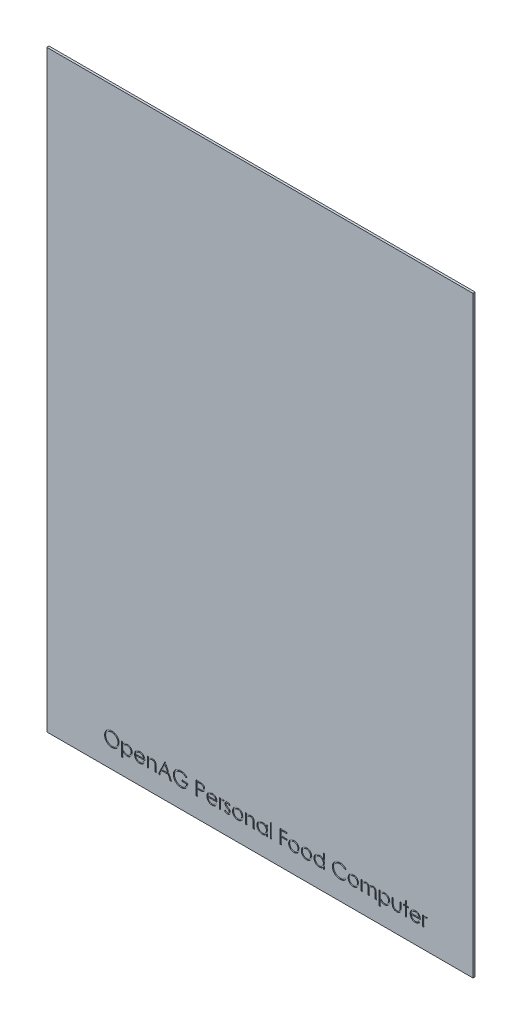
from build123d import *

# Parameters (mm, degrees)
SKETCH1_W           = 584.2
SKETCH1_H           = 812.8
BOSS_EXTRUDE1_DEPTH = 3.0734
SKETCH2_W           = 1.709615385
SKETCH2_H           = 19.538461538
TEXT_2_DEPTH        = 1.27


with BuildPart() as part:
    # Sketch1 → Boss-Extrude1 (new body)
    with BuildSketch(Plane.XY):
        Rectangle(SKETCH1_W, SKETCH1_H)
    extrude(amount=BOSS_EXTRUDE1_DEPTH)

    # Sketch2 → Text 2 (cut)
    # profile 1 of 26: a face of its own
    with BuildSketch(Plane.XY.offset(3.0734)):
        with BuildLine():
            add(Edge.make_bspline(
                [(-202.950105178, -360.260875501), (-202.597363916, -360.269809839), (-201.904550974, -360.287357615), (-200.886329031, -360.42168245), (-199.914261441, -360.654067358), (-198.980429685, -360.963564449), (-198.096003627, -361.376429032), (-197.254326226, -361.875458197), (-196.457400099, -362.465880065), (-195.715966579, -363.143130571), (-195.037476607, -363.88000337), (-194.439709998, -364.666375995), (-193.938736942, -365.497493762), (-193.5273343, -366.37085914), (-193.204580439, -367.284496966), (-192.98186393, -368.243278038), (-192.839597712, -369.240990165), (-192.822965553, -369.921493529), (-192.814528255, -370.266704828)],
                knots=[0, 0, 0, 0, 1.065120563, 2.091984664, 3.0946048, 4.079830382, 5.057816894, 6.036188127, 7.030412546, 8.04752943, 9.064399622, 10.05169764, 11.02544977, 11.989514704, 12.962713494, 13.945757189, 14.957906945, 16, 16, 16, 16], degree=3))
            add(Edge.make_bspline(
                [(-192.814528255, -370.266704828), (-192.822964316, -370.609373215), (-192.83959277, -371.284812303), (-192.982025688, -372.276193049), (-193.205405988, -373.229186697), (-193.524337094, -374.142202321), (-193.933778627, -375.016203061), (-194.438087487, -375.848889196), (-195.032127505, -376.640533709), (-195.708167651, -377.382464072), (-196.44513618, -378.062807448), (-197.235603775, -378.655637329), (-198.061793131, -379.16576435), (-198.934335971, -379.572801204), (-199.841660457, -379.898131228), (-200.791887101, -380.119941972), (-201.780563345, -380.263018593), (-202.454775523, -380.279447944), (-202.797460947, -380.287798578)],
                knots=[0, 0, 0, 0, 1.043624062, 2.057103931, 3.04512605, 4.022047818, 4.998200453, 5.980619268, 6.982898556, 8.009068085, 9.034988726, 10.034168286, 11.015286542, 11.987931943, 12.962482838, 13.94673481, 14.956375938, 16, 16, 16, 16], degree=3))
            add(Edge.make_bspline(
                [(-202.797460947, -380.287798578), (-203.142670455, -380.279365487), (-203.823170287, -380.262741619), (-204.822136151, -380.120239973), (-205.781590728, -379.897402305), (-206.698790268, -379.578943802), (-207.574246242, -379.167370018), (-208.409670835, -378.665514754), (-209.201710765, -378.070027315), (-209.943799414, -377.394206387), (-210.622791478, -376.65848694), (-211.214753223, -375.87017478), (-211.71672134, -375.044735795), (-212.126913193, -374.17987927), (-212.451658321, -373.279786132), (-212.673208832, -372.338452276), (-212.816551656, -371.361244395), (-212.833069892, -370.695893762), (-212.841451332, -370.358291366)],
                knots=[0, 0, 0, 0, 1.053102029, 2.075944431, 3.073151272, 4.055350789, 5.033113405, 6.020478099, 7.024410459, 8.052272461, 9.079885166, 10.07527673, 11.055994387, 12.023226415, 12.992069828, 13.970394897, 14.97016774, 16, 16, 16, 16], degree=3))
            add(Edge.make_bspline(
                [(-212.841451332, -370.358291366), (-212.838541387, -370.131690696), (-212.832758208, -369.681348024), (-212.763134853, -369.012602671), (-212.662106165, -368.354612091), (-212.517315755, -367.70924736), (-212.327949682, -367.078088286), (-212.104509362, -366.456781991), (-211.831605346, -365.851624866), (-211.523100676, -365.25975012), (-211.178775693, -364.690384233), (-210.798451971, -364.152196787), (-210.395488036, -363.640671648), (-209.95372728, -363.169064384), (-209.487729199, -362.723655483), (-208.989934313, -362.311289837), (-208.463380097, -361.928249033), (-207.905800859, -361.583061176), (-207.330935677, -361.270863601), (-206.738334929, -361.002956097), (-206.136047018, -360.77301682), (-205.521251006, -360.5866489), (-204.89557949, -360.43951739), (-204.257666919, -360.339328793), (-203.608021499, -360.269527863), (-203.170354177, -360.26377203), (-202.950105178, -360.260875501)],
                knots=[0, 0, 0, 0, 1.037015668, 2.060948919, 3.074880161, 4.083647147, 5.086022904, 6.090072063, 7.104153813, 8.122640571, 9.144368836, 10.147691507, 11.138137339, 12.123020368, 13.103399296, 14.087645067, 15.080126199, 16.082011238, 17.087798457, 18.072939717, 19.057185487, 20.037253025, 21.01195951, 21.997135196, 22.992090687, 24, 24, 24, 24], degree=3))
        make_face()
        with BuildLine():
            add(Edge.make_bspline(
                [(-202.866150851, -362.214721655), (-203.046933356, -362.216925415), (-203.406770074, -362.221311866), (-203.941718764, -362.27909169), (-204.469632004, -362.361441514), (-204.990618818, -362.478906648), (-205.502499336, -362.638948707), (-206.0100449, -362.823139936), (-206.508627236, -363.047500443), (-206.996600377, -363.30098902), (-207.469666714, -363.581562432), (-207.916050132, -363.891651621), (-208.336906237, -364.223984609), (-208.731204589, -364.579336981), (-209.097787397, -364.959518385), (-209.443869844, -365.358765216), (-209.755579995, -365.78848908), (-210.041251492, -366.237037152), (-210.296890737, -366.703825186), (-210.524213596, -367.183938865), (-210.710163416, -367.68129456), (-210.861814349, -368.190496475), (-210.98754332, -368.710738149), (-211.067193678, -369.245966126), (-211.125608377, -369.79349095), (-211.129744108, -370.16350647), (-211.131835947, -370.350659155)],
                knots=[0, 0, 0, 0, 1.008559885, 2.007477868, 2.99961109, 3.989939068, 4.984837346, 5.991145699, 7.001802488, 8.033829008, 9.059044045, 10.069351652, 11.065060232, 12.050310815, 13.029377138, 14.011219647, 14.996725999, 15.989392538, 16.977580475, 17.965360261, 18.951710183, 19.937753436, 20.929683414, 21.935841486, 22.955955122, 24, 24, 24, 24], degree=3))
            add(Edge.make_bspline(
                [(-211.131835947, -370.350659155), (-211.124897056, -370.6258621), (-211.111246109, -371.167271428), (-210.991734192, -371.960666612), (-210.807646017, -372.723147142), (-210.536279494, -373.450540962), (-210.196914005, -374.149100559), (-209.777667645, -374.812628957), (-209.28095748, -375.441305488), (-208.716731713, -376.030741166), (-208.09993241, -376.568744757), (-207.444978552, -377.040985596), (-206.758886774, -377.440547099), (-206.039867913, -377.766057564), (-205.291760594, -378.023993137), (-204.509744209, -378.200769686), (-203.699028136, -378.317113236), (-203.146411284, -378.328286093), (-202.866150851, -378.333952424)],
                knots=[0, 0, 0, 0, 1.032063989, 2.030389145, 3.003944642, 3.970395727, 4.937377036, 5.913328081, 6.909231446, 7.93887556, 8.970685674, 9.976071282, 10.964166581, 11.944589148, 12.933237628, 13.927779006, 14.949070134, 16, 16, 16, 16], degree=3))
            add(Edge.make_bspline(
                [(-202.866150851, -378.333952424), (-202.677776278, -378.331364322), (-202.304172923, -378.326231337), (-201.74848158, -378.274531396), (-201.202801341, -378.191626507), (-200.66789759, -378.072261082), (-200.144377402, -377.922869858), (-199.630055688, -377.745390653), (-199.130410708, -377.523968673), (-198.639139305, -377.279323394), (-198.168896903, -377.000430536), (-197.719994363, -376.70086575), (-197.30374653, -376.369022258), (-196.909743156, -376.018949592), (-196.541655306, -375.64358922), (-196.20197212, -375.243429156), (-195.891837401, -374.815943578), (-195.606274381, -374.36807587), (-195.351530908, -373.900010552), (-195.129576098, -373.418156162), (-194.941274382, -372.923699209), (-194.78926352, -372.415926513), (-194.670144078, -371.895802465), (-194.588066229, -371.362630639), (-194.530652584, -370.817477647), (-194.526325092, -370.448757516), (-194.524143639, -370.262888722)],
                knots=[0, 0, 0, 0, 1.047197238, 2.076906641, 3.100256066, 4.114471768, 5.12198147, 6.126382909, 7.136867548, 8.15857795, 9.17633901, 10.174870724, 11.156907918, 12.133735059, 13.104061851, 14.077631395, 15.04955518, 16.038496417, 17.029181396, 18.010275684, 18.986308667, 19.968651475, 20.955262928, 21.950658345, 22.966943676, 24, 24, 24, 24], degree=3))
            add(Edge.make_bspline(
                [(-194.524143639, -370.262888722), (-194.52632684, -370.078291477), (-194.530657621, -369.712108839), (-194.588038804, -369.170757813), (-194.670230793, -368.641422476), (-194.788682104, -368.12618092), (-194.941355083, -367.624901805), (-195.129608982, -367.138055935), (-195.35159754, -366.663829616), (-195.606368019, -366.203394943), (-195.892748429, -365.76157244), (-196.205681382, -365.339193595), (-196.55056992, -364.944190532), (-196.917560141, -364.566811697), (-197.315818817, -364.215105755), (-197.743541903, -363.888956035), (-198.195536778, -363.580491499), (-198.674112159, -363.30222237), (-199.168018536, -363.045242046), (-199.674824507, -362.825073015), (-200.188788607, -362.637990479), (-200.708603847, -362.478422427), (-201.238645486, -362.361901577), (-201.77533204, -362.279017477), (-202.31792099, -362.221331977), (-202.682827658, -362.216932088), (-202.866150851, -362.214721655)],
                knots=[0, 0, 0, 0, 1.02996197, 2.043119294, 3.035359645, 4.018872909, 4.991431989, 5.957985074, 6.929999688, 7.912076566, 8.892894881, 9.867085534, 10.843653904, 11.817741046, 12.803660682, 13.806313499, 14.818574707, 15.856120519, 16.894564902, 17.924820532, 18.937903209, 19.946497019, 20.957711757, 21.963978472, 22.977135795, 24, 24, 24, 24], degree=3))
        make_face(mode=Mode.SUBTRACT)
    # profile 2 of 26: a face of its own
    with BuildSketch(Plane.XY.offset(3.0734)):
        with BuildLine():
            Line((-189.395297485, -365.878183193), (-187.685682101, -365.878183193))
            Line((-187.685682101, -365.878183193), (-187.685682101, -368.454054588))
            add(Edge.make_bspline(
                [(-187.685682101, -368.454054588), (-187.504122081, -368.220350636), (-187.151296515, -367.766193776), (-186.543193819, -367.178418934), (-185.901335044, -366.682709067), (-185.209202756, -366.294184137), (-184.477553815, -366.001245147), (-183.709390773, -365.784731284), (-182.898194067, -365.657142686), (-182.343586232, -365.641784787), (-182.060742197, -365.633952424)],
                knots=[0, 0, 0, 0, 1.0828784, 2.104357462, 3.088488658, 4.04616522, 5.001424249, 5.969181776, 6.964304535, 8, 8, 8, 8], degree=3))
            add(Edge.make_bspline(
                [(-182.060742197, -365.633952424), (-181.813682185, -365.641099869), (-181.325355093, -365.65522717), (-180.606553804, -365.750874796), (-179.91435636, -365.914801093), (-179.252678809, -366.151026075), (-178.614432697, -366.443065133), (-178.009066696, -366.811639284), (-177.427151487, -367.238392979), (-176.883321943, -367.729513686), (-176.380829928, -368.260890393), (-175.946238571, -368.832511791), (-175.571378635, -369.425579583), (-175.268373164, -370.049287971), (-175.031019159, -370.698725493), (-174.862210699, -371.376516007), (-174.761748382, -372.080146483), (-174.74826941, -372.558588433), (-174.741451332, -372.800599059)],
                knots=[0, 0, 0, 0, 1.041296284, 2.058176809, 3.050446431, 4.034000596, 5.01514041, 6.003636468, 7.015969324, 8.052561599, 9.08815499, 10.094063707, 11.074456064, 12.040834395, 13.011057502, 13.983766392, 14.980127149, 16, 16, 16, 16], degree=3))
            add(Edge.make_bspline(
                [(-174.741451332, -372.800599059), (-174.748121474, -373.047717338), (-174.761275959, -373.535070247), (-174.863302348, -374.250735733), (-175.026353335, -374.939188439), (-175.260712874, -375.59928326), (-175.563561546, -376.230565705), (-175.932067796, -376.832580517), (-176.366878425, -377.405134816), (-176.86381742, -377.940455601), (-177.4029484, -378.433574718), (-177.97922445, -378.864856211), (-178.583702316, -379.227031411), (-179.213289397, -379.52956152), (-179.873375373, -379.757574693), (-180.560880499, -379.922045865), (-181.275430467, -380.023470763), (-181.76148388, -380.036817424), (-182.007316716, -380.043567809)],
                knots=[0, 0, 0, 0, 1.038740735, 2.04854663, 3.033179607, 4.009277356, 4.987731542, 5.972001279, 6.972200261, 8.005528982, 9.039189865, 10.040446548, 11.026516639, 11.997840187, 12.972163198, 13.956796175, 14.96660207, 16, 16, 16, 16], degree=3))
            add(Edge.make_bspline(
                [(-182.007316716, -380.043567809), (-182.283963929, -380.036520355), (-182.830423282, -380.022599569), (-183.629422031, -379.881523922), (-184.398371753, -379.670684316), (-185.128753242, -379.362079793), (-185.826352336, -378.968803342), (-186.487222993, -378.489232078), (-187.114875605, -377.924368964), (-187.492657555, -377.495842936), (-187.685682101, -377.276891126)],
                knots=[0, 0, 0, 0, 1.014726462, 2.004382257, 2.969841629, 3.936926163, 4.907207904, 5.903978561, 6.929055279, 8, 8, 8, 8], degree=3))
            Line((-187.685682101, -377.276891126), (-187.685682101, -384.928183193))
            Line((-187.685682101, -384.928183193), (-189.395297485, -384.928183193))
            Line((-189.395297485, -384.928183193), (-189.395297485, -365.878183193))
        make_face()
        with BuildLine():
            add(Edge.make_bspline(
                [(-182.07600662, -367.343567809), (-182.269661096, -367.347052643), (-182.650916844, -367.353913383), (-183.209747064, -367.435414447), (-183.748020749, -367.553729867), (-184.260313085, -367.732864638), (-184.751534298, -367.952749607), (-185.217900966, -368.227515982), (-185.659085726, -368.552193328), (-186.073978563, -368.920562329), (-186.448791632, -369.326461702), (-186.78060414, -369.759646778), (-187.059318186, -370.219568966), (-187.290650611, -370.701944154), (-187.466690478, -371.210553491), (-187.591635181, -371.742500318), (-187.67017753, -372.298366867), (-187.680458746, -372.676950274), (-187.685682101, -372.869288963)],
                knots=[0, 0, 0, 0, 1.05670511, 2.080379991, 3.077984906, 4.06214886, 5.038337365, 6.01289324, 7.01187578, 8.025460281, 9.038092164, 10.024533457, 11.000252242, 11.969694649, 12.940728589, 13.933144304, 14.949937299, 16, 16, 16, 16], degree=3))
            add(Edge.make_bspline(
                [(-187.685682101, -372.869288963), (-187.677023298, -373.121772832), (-187.660059971, -373.616410116), (-187.522152297, -374.339135123), (-187.297714645, -375.023039134), (-186.979151218, -375.662362778), (-186.576665135, -376.250097923), (-186.091716598, -376.776371081), (-185.52869357, -377.237874155), (-184.896956427, -377.626609836), (-184.219744545, -377.942230597), (-183.513338366, -378.168186514), (-182.787452372, -378.3073725), (-182.296679088, -378.325044473), (-182.04929388, -378.333952424)],
                knots=[0, 0, 0, 0, 1.03728447, 2.032128127, 3.01272805, 3.987917167, 4.958271349, 5.931593992, 6.91984656, 7.941419022, 8.973179163, 9.983609215, 10.983593296, 12, 12, 12, 12], degree=3))
            add(Edge.make_bspline(
                [(-182.04929388, -378.333952424), (-181.806892057, -378.325481287), (-181.325768017, -378.308667603), (-180.617335956, -378.163135468), (-179.928865481, -377.940821834), (-179.274741971, -377.616647677), (-178.660659844, -377.219373218), (-178.106133103, -376.742796466), (-177.621681188, -376.190401204), (-177.208762341, -375.575312067), (-176.876032399, -374.915771764), (-176.626040665, -374.233338778), (-176.481758288, -373.530418689), (-176.461310624, -373.056902566), (-176.451066716, -372.819679588)],
                knots=[0, 0, 0, 0, 1.00104056, 1.986885549, 2.97790532, 3.984399681, 4.995088187, 5.994304198, 6.996462723, 8.023150851, 9.048424203, 10.043036403, 11.019596776, 12, 12, 12, 12], degree=3))
            add(Edge.make_bspline(
                [(-176.451066716, -372.819679588), (-176.458984625, -372.580983147), (-176.474758753, -372.105449951), (-176.630136201, -371.404611865), (-176.863634651, -370.719421595), (-177.204134634, -370.068888317), (-177.608001543, -369.455075096), (-178.096481627, -368.913217554), (-178.64412121, -368.438760036), (-179.257472232, -368.046790448), (-179.91573369, -367.734993682), (-180.608690589, -367.507027019), (-181.332827911, -367.370009897), (-181.826101288, -367.35245937), (-182.07600662, -367.343567809)],
                knots=[0, 0, 0, 0, 0.983928682, 1.960191568, 2.949917689, 3.96440592, 4.982380491, 5.975291189, 6.965713506, 7.964880129, 8.970154049, 9.96478489, 10.968906225, 12, 12, 12, 12], degree=3))
        make_face(mode=Mode.SUBTRACT)
    # profile 3 of 26: a face of its own
    with BuildSketch(Plane.XY.offset(3.0734)):
        with BuildLine():
            Line((-159.896799889, -375.403183193), (-158.377989793, -376.200749299))
            add(Edge.make_bspline(
                [(-158.377989793, -376.200749299), (-158.499020404, -376.415433716), (-158.734498045, -376.833124576), (-159.139450687, -377.406975131), (-159.563950396, -377.923217699), (-160.027159136, -378.368060531), (-160.515218389, -378.755871641), (-161.030834696, -379.095167515), (-161.576692404, -379.384284033), (-162.152817334, -379.627865649), (-162.764047748, -379.81515161), (-163.411864859, -379.947436012), (-164.097509713, -380.029205518), (-164.567479634, -380.038704069), (-164.808128014, -380.043567809)],
                knots=[0, 0, 0, 0, 1.120438281, 2.179929193, 3.190490725, 4.156257408, 5.095198341, 6.022838206, 6.959905092, 7.901321166, 8.864066838, 9.862729781, 10.905609505, 12, 12, 12, 12], degree=3))
            add(Edge.make_bspline(
                [(-164.808128014, -380.043567809), (-165.075600778, -380.037323897), (-165.597362652, -380.025143835), (-166.356857561, -379.920137707), (-167.071936967, -379.748838155), (-167.742560667, -379.509539993), (-168.367086356, -379.196971272), (-168.946755294, -378.816191807), (-169.484615856, -378.369157678), (-169.963719052, -377.85199675), (-170.395032185, -377.298556382), (-170.775628434, -376.721853639), (-171.09380388, -376.123339518), (-171.352625944, -375.506824237), (-171.561658138, -374.876193616), (-171.707345482, -374.225709771), (-171.791327396, -373.557133234), (-171.804196736, -373.104846307), (-171.810682101, -372.876921174)],
                knots=[0, 0, 0, 0, 1.145258523, 2.234067595, 3.276747158, 4.290159414, 5.277019952, 6.260822364, 7.254936242, 8.264827045, 9.274100331, 10.257902744, 11.220704747, 12.172965371, 13.118907548, 14.062713208, 15.023725156, 16, 16, 16, 16], degree=3))
            add(Edge.make_bspline(
                [(-171.810682101, -372.876921174), (-171.804917346, -372.663045026), (-171.793492363, -372.239170744), (-171.721479077, -371.611796851), (-171.593853368, -371.002041988), (-171.418722233, -370.409399493), (-171.192564736, -369.834861649), (-170.915892229, -369.278078789), (-170.588273715, -368.739643385), (-170.335329591, -368.399992043), (-170.207917678, -368.228904347)],
                knots=[0, 0, 0, 0, 1.024358464, 2.0301432, 3.019427413, 4.004406732, 4.986367066, 5.972626655, 6.978780325, 8, 8, 8, 8], degree=3))
            add(Edge.make_bspline(
                [(-170.207917678, -368.228904347), (-170.03533729, -368.022789497), (-169.695643424, -367.617088993), (-169.121115261, -367.084024676), (-168.498995621, -366.637472129), (-167.837080913, -366.267319002), (-167.127678104, -365.986066723), (-166.380323249, -365.776475454), (-165.586506558, -365.659029423), (-165.043825285, -365.6424405), (-164.766150851, -365.633952424)],
                knots=[0, 0, 0, 0, 1.030682036, 2.02871468, 2.997146059, 3.962720338, 4.930598197, 5.918074684, 6.934738563, 8, 8, 8, 8], degree=3))
            add(Edge.make_bspline(
                [(-164.766150851, -365.633952424), (-164.480686028, -365.641322319), (-163.920669118, -365.655780372), (-163.104065716, -365.789817987), (-162.331393816, -366.002375462), (-161.602962614, -366.302569665), (-160.918698258, -366.68988094), (-160.283048473, -367.169624391), (-159.685142384, -367.727071409), (-159.337297119, -368.155768306), (-159.160291476, -368.373916366)],
                knots=[0, 0, 0, 0, 1.056321875, 2.072262726, 3.055038591, 4.01806755, 4.982017516, 5.957941055, 6.960871419, 8, 8, 8, 8], degree=3))
            add(Edge.make_bspline(
                [(-159.160291476, -368.373916366), (-159.039857712, -368.538310145), (-158.799791826, -368.866003448), (-158.499089753, -369.400335032), (-158.238064503, -369.959374124), (-158.029423673, -370.552157312), (-157.860480102, -371.171661027), (-157.738250846, -371.822314021), (-157.666570493, -372.503922538), (-157.652480583, -372.96834279), (-157.645297485, -373.20510627)],
                knots=[0, 0, 0, 0, 0.94817472, 1.890038105, 2.849395472, 3.817997239, 4.812318967, 5.836947057, 6.897266129, 8, 8, 8, 8], degree=3))
            Line((-157.645297485, -373.20510627), (-170.101066716, -373.20510627))
            add(Edge.make_bspline(
                [(-170.101066716, -373.20510627), (-170.092686858, -373.388533083), (-170.076208206, -373.749234512), (-169.999381498, -374.277032631), (-169.878284601, -374.779807536), (-169.70809156, -375.253788093), (-169.501987731, -375.70516493), (-169.249516901, -376.130589731), (-168.948311614, -376.528124751), (-168.612347451, -376.901325885), (-168.238384546, -377.233670885), (-167.844959879, -377.531132696), (-167.426439189, -377.780446015), (-166.986122478, -377.982810844), (-166.524721762, -378.141232364), (-166.042091671, -378.249370074), (-165.539181923, -378.321798756), (-165.196359571, -378.329852362), (-165.021829937, -378.333952424)],
                knots=[0, 0, 0, 0, 1.094153842, 2.151609401, 3.174256925, 4.172055639, 5.149267565, 6.128595816, 7.11444997, 8.118368179, 9.117203808, 10.09244225, 11.054858984, 12.015122123, 12.976791628, 13.957293641, 14.960065497, 16, 16, 16, 16], degree=3))
            add(Edge.make_bspline(
                [(-165.021829937, -378.333952424), (-164.85119012, -378.330642859), (-164.512607988, -378.324076046), (-164.008377036, -378.260220931), (-163.512317608, -378.15696843), (-163.026482828, -378.016052913), (-162.560732938, -377.844184618), (-162.129410729, -377.636796207), (-161.732734127, -377.407381157), (-161.361983209, -377.144982783), (-161.002368231, -376.823809651), (-160.645629841, -376.423020941), (-160.263124056, -375.949015968), (-160.023694987, -375.592260272), (-159.896799889, -375.403183193)],
                knots=[0, 0, 0, 0, 0.99110716, 1.966546729, 2.947904876, 3.932708344, 4.903319531, 5.828989031, 6.710028674, 7.56322171, 8.463672341, 9.504779593, 10.677557249, 12, 12, 12, 12], degree=3))
        make_face()
        with BuildLine():
            add(Edge.make_bspline(
                [(-159.35491287, -371.495490886), (-159.417487355, -371.268725816), (-159.537923096, -370.832276052), (-159.789581023, -370.227896349), (-160.07299898, -369.690752202), (-160.408397261, -369.224954485), (-160.78841061, -368.811278221), (-161.227350818, -368.44977135), (-161.719580467, -368.126370652), (-162.262555219, -367.853397763), (-162.837548363, -367.62104296), (-163.439562065, -367.465240544), (-164.053830882, -367.358508607), (-164.469307498, -367.34856936), (-164.678380418, -367.343567809)],
                knots=[0, 0, 0, 0, 1.154881502, 2.222775134, 3.210006277, 4.132804581, 5.035138423, 5.962687519, 6.919655026, 7.923214229, 8.944639381, 9.960483929, 10.97369054, 12, 12, 12, 12], degree=3))
            add(Edge.make_bspline(
                [(-164.678380418, -367.343567809), (-164.849010934, -367.34689705), (-165.186311589, -367.353478259), (-165.68325026, -367.415908534), (-166.160478336, -367.519104261), (-166.621517116, -367.660427811), (-167.060324985, -367.84879749), (-167.485927938, -368.069686195), (-167.887504094, -368.339333958), (-168.138644574, -368.544850011), (-168.265519841, -368.648675982)],
                knots=[0, 0, 0, 0, 1.04873581, 2.073130211, 3.073294108, 4.04793562, 5.032784715, 6.005352987, 6.992311501, 8, 8, 8, 8], degree=3))
            add(Edge.make_bspline(
                [(-168.265519841, -368.648675982), (-168.35637899, -368.730832185), (-168.540255764, -368.897096318), (-168.785949173, -369.183549571), (-169.021192032, -369.492440217), (-169.235279485, -369.835585823), (-169.431644634, -370.209078921), (-169.615395367, -370.609769192), (-169.780784267, -371.04069723), (-169.873835952, -371.340992935), (-169.921709745, -371.495490886)],
                knots=[0, 0, 0, 0, 0.879870761, 1.780643979, 2.707998968, 3.669668524, 4.684282772, 5.740141944, 6.837334558, 8, 8, 8, 8], degree=3))
            Line((-169.921709745, -371.495490886), (-159.35491287, -371.495490886))
        make_face(mode=Mode.SUBTRACT)
    # profile 4 of 26: a face of its own
    with BuildSketch(Plane.XY.offset(3.0734)):
        with BuildLine():
            Line((-154.226066716, -365.878183193), (-152.516451332, -365.878183193))
            Line((-152.516451332, -365.878183193), (-152.516451332, -368.389180789))
            add(Edge.make_bspline(
                [(-152.516451332, -368.389180789), (-152.333910775, -368.161436827), (-151.979684455, -367.719491721), (-151.389764013, -367.138626879), (-150.766317927, -366.659953583), (-150.113164165, -366.278388648), (-149.429416067, -365.990752011), (-148.719241484, -365.7830203), (-147.978388583, -365.658461448), (-147.474573577, -365.642186052), (-147.219696524, -365.633952424)],
                knots=[0, 0, 0, 0, 1.12780773, 2.188550248, 3.19190651, 4.159438251, 5.104880172, 6.052711206, 7.014878035, 8, 8, 8, 8], degree=3))
            add(Edge.make_bspline(
                [(-147.219696524, -365.633952424), (-146.962082644, -365.643451274), (-146.457870141, -365.662042813), (-145.723748121, -365.809090803), (-145.038092935, -366.060252835), (-144.403349353, -366.404307104), (-143.831156949, -366.832150909), (-143.328645972, -367.330595693), (-142.913011725, -367.903924946), (-142.634351792, -368.435818125), (-142.45078791, -368.907652848), (-142.33522333, -369.311767302), (-142.237083274, -369.761990382), (-142.152001902, -370.256961574), (-142.094432194, -370.800148866), (-142.049026293, -371.38932559), (-142.016485114, -372.0243009), (-142.01519403, -372.463466687), (-142.014528255, -372.689931991)],
                knots=[0, 0, 0, 0, 1.235846778, 2.418850247, 3.575807741, 4.728682307, 5.871620074, 6.994088408, 8.11269785, 9.256955736, 9.865816715, 10.540099792, 11.271859618, 12.076849838, 12.949306005, 13.892391288, 14.913166135, 16, 16, 16, 16], degree=3))
            Line((-142.014528255, -372.689931991), (-142.014528255, -379.799337039))
            Line((-142.014528255, -379.799337039), (-143.724143639, -379.799337039))
            Line((-143.724143639, -379.799337039), (-143.724143639, -373.250899539))
            add(Edge.make_bspline(
                [(-143.724143639, -373.250899539), (-143.725195243, -373.061365946), (-143.727206782, -372.698820439), (-143.73355123, -372.17974047), (-143.748844606, -371.709006379), (-143.770334709, -371.287743565), (-143.801789147, -370.91635654), (-143.834569469, -370.594088905), (-143.874655985, -370.321349825), (-143.910376984, -370.15716559), (-143.926397245, -370.083531751)],
                knots=[0, 0, 0, 0, 1.430800155, 2.736877192, 3.918605307, 4.986035426, 5.920637409, 6.731861385, 7.431261377, 8, 8, 8, 8], degree=3))
            add(Edge.make_bspline(
                [(-143.926397245, -370.083531751), (-143.984230495, -369.867389444), (-144.095541608, -369.451382377), (-144.370590859, -368.887097686), (-144.717922329, -368.40704755), (-145.141909195, -368.014199965), (-145.638456021, -367.708470125), (-146.206184898, -367.496340457), (-146.839617214, -367.363663906), (-147.285138925, -367.350453374), (-147.517352774, -367.343567809)],
                knots=[0, 0, 0, 0, 1.084156227, 2.086665306, 3.027808233, 3.945421172, 4.874247719, 5.839848303, 6.874090471, 8, 8, 8, 8], degree=3))
            add(Edge.make_bspline(
                [(-147.517352774, -367.343567809), (-147.654881166, -367.346158634), (-147.927046301, -367.351285811), (-148.330634005, -367.402727876), (-148.722107005, -367.486866041), (-149.105394142, -367.600451054), (-149.47282942, -367.75645569), (-149.836217919, -367.933508406), (-150.181876164, -368.154206531), (-150.517174654, -368.400172627), (-150.829120078, -368.672746598), (-151.119378606, -368.960371718), (-151.378121259, -369.26667179), (-151.612537906, -369.586711504), (-151.814893882, -369.924886222), (-151.991531404, -370.277933376), (-152.141404257, -370.646317643), (-152.215877198, -370.901996191), (-152.253140034, -371.029925982)],
                knots=[0, 0, 0, 0, 1.023777757, 2.026029729, 3.023749952, 4.003683103, 4.997618607, 5.993177895, 7.010360494, 8.046726602, 9.087585522, 10.09234134, 11.086953743, 12.070360549, 13.043493632, 14.017870808, 15.008233677, 16, 16, 16, 16], degree=3))
            add(Edge.make_bspline(
                [(-152.253140034, -371.029925982), (-152.274582978, -371.123843587), (-152.321263146, -371.328297301), (-152.371681311, -371.663819069), (-152.417442543, -372.051949076), (-152.455743703, -372.492234401), (-152.47917747, -372.98621655), (-152.504728401, -373.531785896), (-152.514030576, -374.131117883), (-152.515621817, -374.548376524), (-152.516451332, -374.76589353)],
                knots=[0, 0, 0, 0, 0.615963638, 1.340920617, 2.168419149, 3.115676021, 4.16674242, 5.331190069, 6.6087489, 8, 8, 8, 8], degree=3))
            Line((-152.516451332, -374.76589353), (-152.516451332, -379.799337039))
            Line((-152.516451332, -379.799337039), (-154.226066716, -379.799337039))
            Line((-154.226066716, -379.799337039), (-154.226066716, -365.878183193))
        make_face()
    # profile 5 of 26: a face of its own
    with BuildSketch(Plane.XY.offset(3.0734)):
        Polygon((-129.802989793, -360.749337039), (-121.010682101, -379.799337039), (-122.86912561, -379.799337039), (-125.685411668, -373.693567809), (-134.321259024, -373.693567809), (-137.217683303, -379.799337039), (-139.083759024, -379.799337039), (-130.047220562, -360.749337039), align=None)
        Polygon((-129.944185707, -364.462407953), (-133.393945322, -371.739721655), (-126.58601263, -371.739721655), align=None, mode=Mode.SUBTRACT)
    # profile 6 of 26: a face of its own
    with BuildSketch(Plane.XY.offset(3.0734)):
        with BuildLine():
            Line((-99.762605178, -364.000659155), (-101.227989793, -365.389721655))
            add(Edge.make_bspline(
                [(-101.227989793, -365.389721655), (-101.493159741, -365.140270815), (-102.017176509, -364.647317432), (-102.871488687, -364.007721873), (-103.762830752, -363.459810671), (-104.686551628, -363.014006727), (-105.619776042, -362.658300987), (-106.550116953, -362.405054967), (-107.468031414, -362.243551585), (-108.078541559, -362.224238317), (-108.379372005, -362.214721655)],
                knots=[0, 0, 0, 0, 1.08915593, 2.152340314, 3.188132944, 4.216796309, 5.218260357, 6.173443236, 7.099959455, 8, 8, 8, 8], degree=3))
            add(Edge.make_bspline(
                [(-108.379372005, -362.214721655), (-108.563964872, -362.216972853), (-108.932671855, -362.22146941), (-109.480342722, -362.278860067), (-110.022269704, -362.361400256), (-110.557429786, -362.480826761), (-111.086863502, -362.6321875), (-111.608729501, -362.821519807), (-112.124001275, -363.042256207), (-112.62782523, -363.297321957), (-113.116269971, -363.577519407), (-113.577589319, -363.888026464), (-114.014723676, -364.218891163), (-114.419456848, -364.578397208), (-114.794116936, -364.963288118), (-115.147621646, -365.366404113), (-115.467538071, -365.79875866), (-115.756505697, -366.252396996), (-116.01428822, -366.719351626), (-116.241846748, -367.195128041), (-116.432875185, -367.678148163), (-116.584020363, -368.1690181), (-116.70871978, -368.663940311), (-116.796445613, -369.166341718), (-116.845903344, -369.676760263), (-116.854458317, -370.018556769), (-116.858759024, -370.190382713)],
                knots=[0, 0, 0, 0, 1.02818874, 2.053710826, 3.065248034, 4.081641283, 5.106893873, 6.131558223, 7.173050175, 8.228653731, 9.27666206, 10.308777013, 11.325269123, 12.329503258, 13.32196095, 14.316845687, 15.314881793, 16.315733098, 17.311955233, 18.285320748, 19.252783886, 20.203351036, 21.145449891, 22.095197417, 23.042428769, 24, 24, 24, 24], degree=3))
            add(Edge.make_bspline(
                [(-116.858759024, -370.190382713), (-116.854645757, -370.366028161), (-116.846430456, -370.716839427), (-116.793850717, -371.240410022), (-116.696269865, -371.75620457), (-116.56581705, -372.26591798), (-116.402635753, -372.770423201), (-116.199221671, -373.267533004), (-115.958290331, -373.757228991), (-115.679417098, -374.235098877), (-115.373603619, -374.700588475), (-115.031013421, -375.139062444), (-114.667100817, -375.556359646), (-114.268608019, -375.943214875), (-113.848313082, -376.309975796), (-113.393658837, -376.646537708), (-112.913585445, -376.959383466), (-112.407360477, -377.244570236), (-111.880476761, -377.499342409), (-111.340236434, -377.725895329), (-110.784913609, -377.912472865), (-110.217426684, -378.064535974), (-109.638452162, -378.18917902), (-109.045051179, -378.269365806), (-108.441586866, -378.327554471), (-108.034795169, -378.33180899), (-107.829852774, -378.333952424)],
                knots=[0, 0, 0, 0, 0.93586088, 1.869166235, 2.799637598, 3.729985548, 4.670839027, 5.622275134, 6.589130586, 7.576015415, 8.568469353, 9.55398029, 10.53834874, 11.515998671, 12.510579167, 13.508179873, 14.527009472, 15.561807829, 16.601455013, 17.643573243, 18.680854198, 19.719860599, 20.772568776, 21.833555941, 22.908541556, 24, 24, 24, 24], degree=3))
            add(Edge.make_bspline(
                [(-107.829852774, -378.333952424), (-107.582864913, -378.328789459), (-107.097864119, -378.318651137), (-106.384923624, -378.239728134), (-105.700195482, -378.116464871), (-105.045603719, -377.935947633), (-104.420388049, -377.705694774), (-103.822256468, -377.42813417), (-103.255918155, -377.092619806), (-102.719670596, -376.713939186), (-102.2256922, -376.292037027), (-101.780171896, -375.836772207), (-101.390215734, -375.350354587), (-101.050011585, -374.835649085), (-100.768568766, -374.288395353), (-100.537558696, -373.711275263), (-100.360484637, -373.104029234), (-100.287795417, -372.684430496), (-100.251066716, -372.472413963)],
                knots=[0, 0, 0, 0, 1.13008108, 2.219097802, 3.278683437, 4.311054135, 5.322181354, 6.324827112, 7.324222904, 8.330512327, 9.32562643, 10.293043162, 11.24128371, 12.174520618, 13.111833804, 14.052305215, 15.015860969, 16, 16, 16, 16], degree=3))
            Line((-100.251066716, -372.472413963), (-106.601066716, -372.472413963))
            Line((-106.601066716, -372.472413963), (-106.601066716, -370.518567809))
            Line((-106.601066716, -370.518567809), (-98.541451332, -370.518567809))
            add(Edge.make_bspline(
                [(-98.541451332, -370.518567809), (-98.550736021, -370.882735712), (-98.568907834, -371.595478082), (-98.696373647, -372.634901985), (-98.902203521, -373.616639344), (-99.183383218, -374.541724063), (-99.547375815, -375.408845189), (-99.990274863, -376.218883118), (-100.519168836, -376.966604766), (-101.115218525, -377.658114343), (-101.784145438, -378.274949055), (-102.507874641, -378.817089946), (-103.287601854, -379.273759895), (-104.122589521, -379.645292929), (-105.010104166, -379.935255673), (-105.95219949, -380.140840969), (-106.947597916, -380.264012627), (-107.629787544, -380.279749992), (-107.978680899, -380.287798578)],
                knots=[0, 0, 0, 0, 1.140356446, 2.231883559, 3.274166699, 4.278491846, 5.25512956, 6.21435461, 7.1637429, 8.11826594, 9.068280886, 10.0076534, 10.945064095, 11.891975133, 12.864533718, 13.863980011, 14.907571808, 16, 16, 16, 16], degree=3))
            add(Edge.make_bspline(
                [(-107.978680899, -380.287798578), (-108.193728921, -380.284700932), (-108.617872931, -380.278591377), (-109.244296411, -380.235171815), (-109.853448031, -380.168330392), (-110.445239051, -380.067391934), (-111.021846313, -379.943759317), (-111.580390054, -379.785444462), (-112.122997964, -379.602190541), (-112.650508715, -379.393752661), (-113.15813432, -379.152244073), (-113.64813579, -378.883858749), (-114.123221703, -378.5899806), (-114.580155901, -378.265527282), (-115.021319184, -377.912925606), (-115.443866927, -377.531468847), (-115.850164663, -377.122323181), (-116.104675186, -376.831788858), (-116.232917678, -376.685394732)],
                knots=[0, 0, 0, 0, 1.107784379, 2.184907829, 3.233506516, 4.263428166, 5.276301166, 6.270063455, 7.25232949, 8.225834625, 9.190232166, 10.146266622, 11.1027726, 12.066435141, 13.031522626, 14.010570082, 14.99756817, 16, 16, 16, 16], degree=3))
            add(Edge.make_bspline(
                [(-116.232917678, -376.685394732), (-116.418986822, -376.453144463), (-116.788036553, -375.992499041), (-117.263079091, -375.254447915), (-117.668035298, -374.490260648), (-117.99660873, -373.697809885), (-118.2531746, -372.877836855), (-118.437177204, -372.031389341), (-118.54498545, -371.157377352), (-118.560516846, -370.56592784), (-118.568374409, -370.266704828)],
                knots=[0, 0, 0, 0, 1.023165419, 2.029347347, 3.013907458, 3.994755782, 4.975994455, 5.96558838, 6.970761222, 8, 8, 8, 8], degree=3))
            add(Edge.make_bspline(
                [(-118.568374409, -370.266704828), (-118.565477512, -370.042642795), (-118.559720538, -369.597366422), (-118.489913086, -368.936291649), (-118.389756796, -368.286955024), (-118.242543542, -367.649887339), (-118.056962444, -367.024663118), (-117.825349899, -366.410992058), (-117.555684108, -365.808512014), (-117.242254479, -365.221369961), (-116.893451921, -364.657357086), (-116.514900007, -364.118743899), (-116.101223269, -363.615339131), (-115.659177274, -363.140767445), (-115.183487942, -362.700990864), (-114.67861165, -362.291937776), (-114.144159312, -361.913059479), (-113.578449533, -361.570323664), (-112.989925993, -361.262455958), (-112.379999414, -360.992548963), (-111.748855982, -360.769482632), (-111.101224139, -360.580213917), (-110.432201743, -360.44025008), (-109.746643749, -360.338747623), (-109.040976711, -360.269293502), (-108.563986323, -360.263707738), (-108.322130418, -360.260875501)],
                knots=[0, 0, 0, 0, 1.008945113, 2.00506715, 2.99143336, 3.967273523, 4.948097931, 5.927297278, 6.919902385, 7.919676788, 8.923139349, 9.905703106, 10.883022732, 11.856032218, 12.825136022, 13.798837087, 14.781400844, 15.773989409, 16.776158564, 17.77167057, 18.775803737, 19.789618931, 20.80898985, 21.851988756, 22.910860228, 24, 24, 24, 24], degree=3))
            add(Edge.make_bspline(
                [(-108.322130418, -360.260875501), (-108.124890835, -360.264029592), (-107.733787919, -360.270283783), (-107.151806433, -360.313634225), (-106.578820454, -360.382344206), (-106.013980389, -360.476107145), (-105.459209738, -360.60381666), (-104.912928099, -360.756642752), (-104.37434358, -360.934579672), (-103.845144109, -361.146790393), (-103.321771398, -361.387656552), (-102.801315381, -361.658783894), (-102.285554342, -361.964808562), (-101.773593857, -362.306639234), (-101.262205545, -362.678404979), (-100.759477991, -363.090738548), (-100.253276252, -363.527379548), (-99.92778352, -363.841335434), (-99.762605178, -364.000659155)],
                knots=[0, 0, 0, 0, 0.985871117, 1.954866573, 2.915460327, 3.869826059, 4.81536089, 5.759505086, 6.70452669, 7.649098992, 8.607881297, 9.583363685, 10.581137262, 11.603961102, 12.659522466, 13.73993555, 14.853081303, 16, 16, 16, 16], degree=3))
        make_face()
    # profile 7 of 26: a face of its own
    with BuildSketch(Plane.XY.offset(3.0734)):
        with BuildLine():
            Line((-87.306835947, -360.749337039), (-83.570868399, -360.749337039))
            add(Edge.make_bspline(
                [(-83.570868399, -360.749337039), (-83.313906181, -360.749619503), (-82.82155516, -360.750160717), (-82.115534643, -360.766569547), (-81.474313104, -360.788486257), (-80.899273173, -360.818867704), (-80.388645553, -360.854772003), (-79.944740823, -360.905129531), (-79.564069809, -360.95770914), (-79.335978992, -361.011165653), (-79.231956139, -361.035544972)],
                knots=[0, 0, 0, 0, 1.415646017, 2.712440637, 3.8905458, 4.950247383, 5.884950622, 6.709939814, 7.411656543, 8, 8, 8, 8], degree=3))
            add(Edge.make_bspline(
                [(-79.231956139, -361.035544972), (-79.100274191, -361.071587299), (-78.840013215, -361.142822661), (-78.464994681, -361.285500213), (-78.108194464, -361.454675997), (-77.768388411, -361.647483441), (-77.449752216, -361.872194869), (-77.147531907, -362.119701275), (-76.864394586, -362.395717098), (-76.601932438, -362.697146553), (-76.360896612, -363.01892941), (-76.153362196, -363.365869261), (-75.97958686, -363.732126213), (-75.830543625, -364.117445507), (-75.723273323, -364.525062839), (-75.642463769, -364.952145945), (-75.59117231, -365.398649045), (-75.586259795, -365.703774895), (-75.583759024, -365.859102664)],
                knots=[0, 0, 0, 0, 0.999701418, 1.975846123, 2.934577507, 3.890451536, 4.834027766, 5.787354733, 6.749476667, 7.726910423, 8.712836071, 9.690891519, 10.682875813, 11.679750201, 12.712814741, 13.765529915, 14.8625177, 16, 16, 16, 16], degree=3))
            add(Edge.make_bspline(
                [(-75.583759024, -365.859102664), (-75.586052779, -366.015735992), (-75.590540664, -366.322199678), (-75.644404732, -366.770542996), (-75.71695906, -367.198995948), (-75.828521588, -367.606608529), (-75.974638752, -367.990960079), (-76.146045496, -368.357924214), (-76.352784426, -368.701257856), (-76.590336999, -369.022207453), (-76.854596391, -369.321074262), (-77.144444526, -369.5956925), (-77.458711247, -369.844454685), (-77.796397796, -370.067918499), (-78.160796259, -370.260901963), (-78.54637998, -370.433752437), (-78.956500444, -370.57891921), (-79.240304698, -370.65528283), (-79.38460037, -370.694108674)],
                knots=[0, 0, 0, 0, 1.121902311, 2.195077645, 3.232258892, 4.234102512, 5.217864754, 6.176164875, 7.132989551, 8.084763148, 9.034132444, 9.988522005, 10.94243251, 11.903244335, 12.886203696, 13.894208494, 14.929344452, 16, 16, 16, 16], degree=3))
            add(Edge.make_bspline(
                [(-79.38460037, -370.694108674), (-79.503947717, -370.719488614), (-79.765504365, -370.775110228), (-80.196266896, -370.837204829), (-80.697801068, -370.890205198), (-81.269422335, -370.929944247), (-81.910617603, -370.96396411), (-82.621733732, -370.991004735), (-83.404166638, -371.005862939), (-83.949928695, -371.006629254), (-84.234870803, -371.007029347)],
                knots=[0, 0, 0, 0, 0.601384939, 1.31797006, 2.144135048, 3.087295005, 4.142315834, 5.309527816, 6.595305764, 8, 8, 8, 8], degree=3))
            Line((-84.234870803, -371.007029347), (-85.597220562, -371.007029347))
            Line((-85.597220562, -371.007029347), (-85.597220562, -379.799337039))
            Line((-85.597220562, -379.799337039), (-87.306835947, -379.799337039))
            Line((-87.306835947, -379.799337039), (-87.306835947, -360.749337039))
        make_face()
        with BuildLine():
            Line((-85.597220562, -362.703183193), (-85.597220562, -369.053183193))
            Line((-85.597220562, -369.053183193), (-82.26194412, -369.095160357))
            add(Edge.make_bspline(
                [(-82.26194412, -369.095160357), (-82.099094238, -369.095244523), (-81.784715899, -369.095407004), (-81.330584455, -369.073716002), (-80.909256763, -369.04867596), (-80.522027002, -369.012013291), (-80.168720616, -368.960190446), (-79.848748495, -368.90787513), (-79.564591712, -368.832190228), (-79.232037485, -368.730283237), (-78.861469551, -368.556478572), (-78.458330466, -368.304202742), (-78.116679131, -367.982634887), (-77.821032402, -367.621077691), (-77.586413266, -367.218855286), (-77.414658508, -366.788494359), (-77.313741637, -366.334408493), (-77.30020964, -366.023685908), (-77.293374409, -365.866734876)],
                knots=[0, 0, 0, 0, 1.160613943, 2.240541288, 3.23993089, 4.169200891, 5.011653406, 5.7853311, 6.478053781, 7.106038997, 8.262395093, 9.384106736, 10.481365981, 11.59014053, 12.70357646, 13.786202915, 14.881775077, 16, 16, 16, 16], degree=3))
            add(Edge.make_bspline(
                [(-77.293374409, -365.866734876), (-77.300246813, -365.713580967), (-77.313908303, -365.409129951), (-77.415449501, -364.962931269), (-77.586079338, -364.537105506), (-77.822607373, -364.139923427), (-78.109669809, -363.779667223), (-78.443313377, -363.466718574), (-78.822752699, -363.215140449), (-79.175712357, -363.052762159), (-79.489227384, -362.953619017), (-79.761544194, -362.884250671), (-80.069014865, -362.8288663), (-80.411739493, -362.784019863), (-80.787061689, -362.745628882), (-81.198205946, -362.719579491), (-81.643614776, -362.704331565), (-81.952826597, -362.703575252), (-82.113115995, -362.703183193)],
                knots=[0, 0, 0, 0, 1.120700087, 2.227813068, 3.331159281, 4.466773991, 5.599788987, 6.693661531, 7.80175334, 8.91857717, 9.525282508, 10.207424825, 10.974604443, 11.810962634, 12.737642355, 13.736264703, 14.826523623, 16, 16, 16, 16], degree=3))
            Line((-82.113115995, -362.703183193), (-85.597220562, -362.703183193))
        make_face(mode=Mode.SUBTRACT)
    # profile 8 of 26: a face of its own
    with BuildSketch(Plane.XY.offset(3.0734)):
        with BuildLine():
            Line((-60.739107582, -375.403183193), (-59.220297485, -376.200749299))
            add(Edge.make_bspline(
                [(-59.220297485, -376.200749299), (-59.341328097, -376.415433716), (-59.576805737, -376.833124576), (-59.981758379, -377.406975131), (-60.406258089, -377.923217699), (-60.869466829, -378.368060531), (-61.357526081, -378.755871641), (-61.873142388, -379.095167515), (-62.419000096, -379.384284033), (-62.995125027, -379.627865649), (-63.606355441, -379.81515161), (-64.254172551, -379.947436012), (-64.939817405, -380.029205518), (-65.409787327, -380.038704069), (-65.650435707, -380.043567809)],
                knots=[0, 0, 0, 0, 1.120438281, 2.179929193, 3.190490725, 4.156257408, 5.095198341, 6.022838206, 6.959905092, 7.901321166, 8.864066838, 9.862729781, 10.905609505, 12, 12, 12, 12], degree=3))
            add(Edge.make_bspline(
                [(-65.650435707, -380.043567809), (-65.91790847, -380.037323897), (-66.439670344, -380.025143835), (-67.199165254, -379.920137707), (-67.914244659, -379.748838155), (-68.584868359, -379.509539993), (-69.209394048, -379.196971272), (-69.789062986, -378.816191807), (-70.326923549, -378.369157678), (-70.806026744, -377.85199675), (-71.237339877, -377.298556382), (-71.617936126, -376.721853639), (-71.936111572, -376.123339518), (-72.194933636, -375.506824237), (-72.40396583, -374.876193616), (-72.549653175, -374.225709771), (-72.633635089, -373.557133234), (-72.646504428, -373.104846307), (-72.652989793, -372.876921174)],
                knots=[0, 0, 0, 0, 1.145258523, 2.234067595, 3.276747158, 4.290159414, 5.277019952, 6.260822364, 7.254936242, 8.264827045, 9.274100331, 10.257902744, 11.220704747, 12.172965371, 13.118907548, 14.062713208, 15.023725156, 16, 16, 16, 16], degree=3))
            add(Edge.make_bspline(
                [(-72.652989793, -372.876921174), (-72.647225038, -372.663045026), (-72.635800055, -372.239170744), (-72.56378677, -371.611796851), (-72.43616106, -371.002041988), (-72.261029925, -370.409399493), (-72.034872428, -369.834861649), (-71.758199921, -369.278078789), (-71.430581408, -368.739643385), (-71.177637283, -368.399992043), (-71.05022537, -368.228904347)],
                knots=[0, 0, 0, 0, 1.024358464, 2.0301432, 3.019427413, 4.004406732, 4.986367066, 5.972626655, 6.978780325, 8, 8, 8, 8], degree=3))
            add(Edge.make_bspline(
                [(-71.05022537, -368.228904347), (-70.877644982, -368.022789497), (-70.537951116, -367.617088993), (-69.963422953, -367.084024676), (-69.341303313, -366.637472129), (-68.679388605, -366.267319002), (-67.969985796, -365.986066723), (-67.222630941, -365.776475454), (-66.42881425, -365.659029423), (-65.886132977, -365.6424405), (-65.608458543, -365.633952424)],
                knots=[0, 0, 0, 0, 1.030682036, 2.02871468, 2.997146059, 3.962720338, 4.930598197, 5.918074684, 6.934738563, 8, 8, 8, 8], degree=3))
            add(Edge.make_bspline(
                [(-65.608458543, -365.633952424), (-65.32299372, -365.641322319), (-64.76297681, -365.655780372), (-63.946373408, -365.789817987), (-63.173701508, -366.002375462), (-62.445270306, -366.302569665), (-61.76100595, -366.68988094), (-61.125356166, -367.169624391), (-60.527450076, -367.727071409), (-60.179604811, -368.155768306), (-60.002599168, -368.373916366)],
                knots=[0, 0, 0, 0, 1.056321875, 2.072262726, 3.055038591, 4.01806755, 4.982017516, 5.957941055, 6.960871419, 8, 8, 8, 8], degree=3))
            add(Edge.make_bspline(
                [(-60.002599168, -368.373916366), (-59.882165404, -368.538310145), (-59.642099519, -368.866003448), (-59.341397446, -369.400335032), (-59.080372196, -369.959374124), (-58.871731365, -370.552157312), (-58.702787794, -371.171661027), (-58.580558538, -371.822314021), (-58.508878185, -372.503922538), (-58.494788276, -372.96834279), (-58.487605178, -373.20510627)],
                knots=[0, 0, 0, 0, 0.94817472, 1.890038105, 2.849395472, 3.817997239, 4.812318967, 5.836947057, 6.897266129, 8, 8, 8, 8], degree=3))
            Line((-58.487605178, -373.20510627), (-70.943374409, -373.20510627))
            add(Edge.make_bspline(
                [(-70.943374409, -373.20510627), (-70.934994551, -373.388533083), (-70.918515898, -373.749234512), (-70.84168919, -374.277032631), (-70.720592293, -374.779807536), (-70.550399252, -375.253788093), (-70.344295423, -375.70516493), (-70.091824593, -376.130589731), (-69.790619307, -376.528124751), (-69.454655143, -376.901325885), (-69.080692238, -377.233670885), (-68.687267571, -377.531132696), (-68.268746882, -377.780446015), (-67.82843017, -377.982810844), (-67.367029454, -378.141232364), (-66.884399363, -378.249370074), (-66.381489616, -378.321798756), (-66.038667263, -378.329852362), (-65.86413763, -378.333952424)],
                knots=[0, 0, 0, 0, 1.094153842, 2.151609401, 3.174256925, 4.172055639, 5.149267565, 6.128595816, 7.11444997, 8.118368179, 9.117203808, 10.09244225, 11.054858984, 12.015122123, 12.976791628, 13.957293641, 14.960065497, 16, 16, 16, 16], degree=3))
            add(Edge.make_bspline(
                [(-65.86413763, -378.333952424), (-65.693497812, -378.330642859), (-65.35491568, -378.324076046), (-64.850684728, -378.260220931), (-64.3546253, -378.15696843), (-63.86879052, -378.016052913), (-63.40304063, -377.844184618), (-62.971718422, -377.636796207), (-62.57504182, -377.407381157), (-62.204290901, -377.144982783), (-61.844675923, -376.823809651), (-61.487937533, -376.423020941), (-61.105431748, -375.949015968), (-60.866002679, -375.592260272), (-60.739107582, -375.403183193)],
                knots=[0, 0, 0, 0, 0.99110716, 1.966546729, 2.947904876, 3.932708344, 4.903319531, 5.828989031, 6.710028674, 7.56322171, 8.463672341, 9.504779593, 10.677557249, 12, 12, 12, 12], degree=3))
        make_face()
        with BuildLine():
            add(Edge.make_bspline(
                [(-60.197220562, -371.495490886), (-60.259795047, -371.268725816), (-60.380230788, -370.832276052), (-60.631888715, -370.227896349), (-60.915306672, -369.690752202), (-61.250704953, -369.224954485), (-61.630718302, -368.811278221), (-62.069658511, -368.44977135), (-62.56188816, -368.126370652), (-63.104862911, -367.853397763), (-63.679856056, -367.62104296), (-64.281869758, -367.465240544), (-64.896138574, -367.358508607), (-65.31161519, -367.34856936), (-65.52068811, -367.343567809)],
                knots=[0, 0, 0, 0, 1.154881502, 2.222775134, 3.210006277, 4.132804581, 5.035138423, 5.962687519, 6.919655026, 7.923214229, 8.944639381, 9.960483929, 10.97369054, 12, 12, 12, 12], degree=3))
            add(Edge.make_bspline(
                [(-65.52068811, -367.343567809), (-65.691318626, -367.34689705), (-66.028619281, -367.353478259), (-66.525557953, -367.415908534), (-67.002786028, -367.519104261), (-67.463824808, -367.660427811), (-67.902632677, -367.84879749), (-68.32823563, -368.069686195), (-68.729811787, -368.339333958), (-68.980952266, -368.544850011), (-69.107827534, -368.648675982)],
                knots=[0, 0, 0, 0, 1.04873581, 2.073130211, 3.073294108, 4.04793562, 5.032784715, 6.005352987, 6.992311501, 8, 8, 8, 8], degree=3))
            add(Edge.make_bspline(
                [(-69.107827534, -368.648675982), (-69.198686683, -368.730832185), (-69.382563456, -368.897096318), (-69.628256866, -369.183549571), (-69.863499724, -369.492440217), (-70.077587177, -369.835585823), (-70.273952326, -370.209078921), (-70.457703059, -370.609769192), (-70.623091959, -371.04069723), (-70.716143644, -371.340992935), (-70.764017437, -371.495490886)],
                knots=[0, 0, 0, 0, 0.879870761, 1.780643979, 2.707998968, 3.669668524, 4.684282772, 5.740141944, 6.837334558, 8, 8, 8, 8], degree=3))
            Line((-70.764017437, -371.495490886), (-60.197220562, -371.495490886))
        make_face(mode=Mode.SUBTRACT)
    # profile 9 of 26: a face of its own
    with BuildSketch(Plane.XY.offset(3.0734)):
        with BuildLine():
            Line((-55.556835947, -365.878183193), (-53.847220562, -365.878183193))
            Line((-53.847220562, -365.878183193), (-53.847220562, -367.927431991))
            add(Edge.make_bspline(
                [(-53.847220562, -367.927431991), (-53.721007461, -367.736628126), (-53.479625886, -367.371717215), (-53.078416942, -366.889102877), (-52.667463096, -366.489515266), (-52.244797005, -366.171088971), (-51.80731049, -365.932620424), (-51.364605081, -365.75794262), (-50.909715738, -365.654651804), (-50.604034408, -365.64086146), (-50.450886428, -365.633952424)],
                knots=[0, 0, 0, 0, 1.2804753, 2.448899062, 3.506932113, 4.484331642, 5.4025378, 6.288909075, 7.142734305, 8, 8, 8, 8], degree=3))
            add(Edge.make_bspline(
                [(-50.450886428, -365.633952424), (-50.332088851, -365.64043229), (-50.087655116, -365.653765036), (-49.717635591, -365.747441096), (-49.336399089, -365.897000047), (-49.090695524, -366.037644688), (-48.962605178, -366.110965645)],
                knots=[0, 0, 0, 0, 0.901110191, 1.854092781, 2.881294221, 4, 4, 4, 4], degree=3))
            Line((-48.962605178, -366.110965645), (-49.901367197, -367.591614684))
            add(Edge.make_bspline(
                [(-49.901367197, -367.591614684), (-49.983603441, -367.554928378), (-50.139703574, -367.485290747), (-50.368056285, -367.402874949), (-50.578593275, -367.354346893), (-50.712724642, -367.346995131), (-50.775255418, -367.343567809)],
                knots=[0, 0, 0, 0, 1.180555205, 2.24091978, 3.179933427, 4, 4, 4, 4], degree=3))
            add(Edge.make_bspline(
                [(-50.775255418, -367.343567809), (-50.912446625, -367.352712012), (-51.192276919, -367.371363536), (-51.603128266, -367.517987619), (-52.001802341, -367.754889283), (-52.318422389, -368.017622049), (-52.563580937, -368.270975061), (-52.738515593, -368.492218509), (-52.898985973, -368.740296489), (-53.052312458, -369.010968054), (-53.192010431, -369.308854787), (-53.322392273, -369.630980563), (-53.44027837, -369.977718478), (-53.507498985, -370.219286195), (-53.541932101, -370.343026943)],
                knots=[0, 0, 0, 0, 1.125678352, 2.296057538, 3.5422874, 4.923748041, 5.663163013, 6.437101912, 7.23742474, 8.08941207, 8.991984279, 9.93940061, 10.944477711, 12, 12, 12, 12], degree=3))
            add(Edge.make_bspline(
                [(-53.541932101, -370.343026943), (-53.567689842, -370.453392702), (-53.624741281, -370.697844472), (-53.680212366, -371.107955728), (-53.735019313, -371.592498785), (-53.773645193, -372.152822383), (-53.809448537, -372.787527257), (-53.829641984, -373.497580332), (-53.846531935, -374.283710429), (-53.846984056, -374.833299409), (-53.847220562, -375.120791366)],
                knots=[0, 0, 0, 0, 0.566838948, 1.255505196, 2.06880316, 3.007127437, 4.065329342, 5.249902469, 6.561414163, 8, 8, 8, 8], degree=3))
            Line((-53.847220562, -375.120791366), (-53.847220562, -379.799337039))
            Line((-53.847220562, -379.799337039), (-55.556835947, -379.799337039))
            Line((-55.556835947, -379.799337039), (-55.556835947, -365.878183193))
        make_face()
    # profile 10 of 26: a face of its own
    with BuildSketch(Plane.XY.offset(3.0734)):
        with BuildLine():
            Line((-40.658759024, -367.614511318), (-41.818855178, -368.808952424))
            add(Edge.make_bspline(
                [(-41.818855178, -368.808952424), (-41.918952061, -368.692948013), (-42.111927069, -368.469305166), (-42.417986987, -368.170290561), (-42.722915458, -367.919173793), (-43.022538286, -367.707162213), (-43.324389722, -367.546874715), (-43.624927519, -367.429881252), (-43.924462853, -367.357481424), (-44.124683988, -367.348149979), (-44.223001812, -367.343567809)],
                knots=[0, 0, 0, 0, 1.26578478, 2.440284043, 3.530471711, 4.527705817, 5.468200915, 6.346673037, 7.188140097, 8, 8, 8, 8], degree=3))
            add(Edge.make_bspline(
                [(-44.223001812, -367.343567809), (-44.343503349, -367.349418189), (-44.580633318, -367.360930909), (-44.920408129, -367.475848294), (-45.235825102, -367.652244427), (-45.508822379, -367.902444861), (-45.740076752, -368.189633238), (-45.908879787, -368.510741807), (-46.012108927, -368.856080444), (-46.02519754, -369.09572867), (-46.031835947, -369.217275741)],
                knots=[0, 0, 0, 0, 0.99966794, 1.967205029, 2.953328237, 3.988086729, 5.028030931, 6.008226631, 6.989793394, 8, 8, 8, 8], degree=3))
            add(Edge.make_bspline(
                [(-46.031835947, -369.217275741), (-46.025789955, -369.32728701), (-46.013715013, -369.546999428), (-45.919843802, -369.871110869), (-45.770349895, -370.187107034), (-45.630630695, -370.380670853), (-45.558638832, -370.480406751)],
                knots=[0, 0, 0, 0, 0.960159726, 1.917612774, 2.927026955, 4, 4, 4, 4], degree=3))
            add(Edge.make_bspline(
                [(-45.558638832, -370.480406751), (-45.515294673, -370.533662846), (-45.423042093, -370.647011731), (-45.24991289, -370.804331276), (-45.053847553, -370.978188385), (-44.818063321, -371.152016026), (-44.55271844, -371.335068702), (-44.252058908, -371.520137454), (-43.925626245, -371.721329539), (-43.691924619, -371.848934252), (-43.570447726, -371.91526252)],
                knots=[0, 0, 0, 0, 0.66740084, 1.420478572, 2.27185888, 3.217733974, 4.268547843, 5.408967954, 6.65319498, 8, 8, 8, 8], degree=3))
            add(Edge.make_bspline(
                [(-43.570447726, -371.91526252), (-43.422328113, -371.998238348), (-43.136209795, -372.158520326), (-42.729667733, -372.407311712), (-42.360712553, -372.654588465), (-42.026218133, -372.897706055), (-41.732620574, -373.143466663), (-41.47101208, -373.382450312), (-41.247917835, -373.621877833), (-41.122982891, -373.78915378), (-41.063266235, -373.869108674)],
                knots=[0, 0, 0, 0, 1.27191281, 2.456916733, 3.569705269, 4.599008579, 5.553216877, 6.436649441, 7.252746552, 8, 8, 8, 8], degree=3))
            add(Edge.make_bspline(
                [(-41.063266235, -373.869108674), (-40.964148936, -374.030576953), (-40.766887115, -374.351928797), (-40.559741408, -374.881074809), (-40.439670483, -375.442290544), (-40.423003256, -375.826187342), (-40.414528255, -376.021392328)],
                knots=[0, 0, 0, 0, 0.995354457, 1.980940102, 2.973342416, 4, 4, 4, 4], degree=3))
            add(Edge.make_bspline(
                [(-40.414528255, -376.021392328), (-40.418444574, -376.158928681), (-40.42616211, -376.42995909), (-40.47981816, -376.829110091), (-40.572101674, -377.210842469), (-40.697797678, -377.579298233), (-40.867529765, -377.927417604), (-41.066454204, -378.263983473), (-41.30525908, -378.581715325), (-41.577899282, -378.880195951), (-41.876415471, -379.152805519), (-42.194856024, -379.392421611), (-42.533613087, -379.591490504), (-42.890266107, -379.756220454), (-43.265625424, -379.887220544), (-43.659749727, -379.977912321), (-44.071386234, -380.032192635), (-44.351311332, -380.039728141), (-44.493945322, -380.043567809)],
                knots=[0, 0, 0, 0, 1.032770009, 2.035186124, 3.017557409, 3.978232242, 4.952395191, 5.920591857, 6.910227898, 7.931268572, 8.952309245, 9.941945286, 10.918353717, 11.897095711, 12.887975737, 13.898235213, 14.929059601, 16, 16, 16, 16], degree=3))
            add(Edge.make_bspline(
                [(-44.493945322, -380.043567809), (-44.686443805, -380.038164683), (-45.068766022, -380.027433507), (-45.634222922, -379.926707659), (-46.186785908, -379.769978444), (-46.722273464, -379.553810288), (-47.228710169, -379.280847122), (-47.69206563, -378.953936094), (-48.113949447, -378.583876251), (-48.354078909, -378.300233123), (-48.474143639, -378.158411559)],
                knots=[0, 0, 0, 0, 1.013940152, 2.01379169, 3.017749504, 4.037548394, 5.051665909, 6.043208538, 7.021604269, 8, 8, 8, 8], degree=3))
            Line((-48.474143639, -378.158411559), (-47.340760226, -376.868567809))
            add(Edge.make_bspline(
                [(-47.340760226, -376.868567809), (-47.233141807, -376.984798741), (-47.024507229, -377.210129979), (-46.690853463, -377.51016389), (-46.351331294, -377.761630809), (-46.009331072, -377.971961395), (-45.659790272, -378.134024661), (-45.304667715, -378.247881579), (-44.944685721, -378.321056397), (-44.702902382, -378.329646762), (-44.581715755, -378.333952424)],
                knots=[0, 0, 0, 0, 1.179806542, 2.287233372, 3.337373186, 4.324005949, 5.273901747, 6.200048787, 7.097828587, 8, 8, 8, 8], degree=3))
            add(Edge.make_bspline(
                [(-44.581715755, -378.333952424), (-44.416699615, -378.32649122), (-44.094285759, -378.311913279), (-43.632493301, -378.179558821), (-43.206107348, -377.972022941), (-42.835865996, -377.677647655), (-42.520712805, -377.334989467), (-42.292503742, -376.949014046), (-42.149486273, -376.531049118), (-42.132689623, -376.241313299), (-42.124143639, -376.093898338)],
                knots=[0, 0, 0, 0, 1.072336372, 2.095165389, 3.102688358, 4.141489647, 5.156069229, 6.117746104, 7.042326257, 8, 8, 8, 8], degree=3))
            add(Edge.make_bspline(
                [(-42.124143639, -376.093898338), (-42.130056184, -375.97247027), (-42.141729713, -375.732726806), (-42.233405236, -375.385742807), (-42.378255189, -375.056617151), (-42.520883347, -374.863996356), (-42.593524649, -374.76589353)],
                knots=[0, 0, 0, 0, 1.013901739, 2.00181326, 2.98231254, 4, 4, 4, 4], degree=3))
            add(Edge.make_bspline(
                [(-42.593524649, -374.76589353), (-42.637189396, -374.716715344), (-42.732306984, -374.609587495), (-42.906779083, -374.454873852), (-43.115686076, -374.288115055), (-43.361377534, -374.112138835), (-43.644348749, -373.929266426), (-43.965746608, -373.740457238), (-44.321168186, -373.536743473), (-44.572468337, -373.401653635), (-44.703831139, -373.331037761)],
                knots=[0, 0, 0, 0, 0.615000592, 1.339693406, 2.178160186, 3.116406724, 4.166410947, 5.330106347, 6.604359322, 8, 8, 8, 8], degree=3))
            add(Edge.make_bspline(
                [(-44.703831139, -373.331037761), (-44.84559928, -373.251903344), (-45.120532949, -373.098436455), (-45.509954632, -372.859407504), (-45.86127666, -372.616289909), (-46.182952645, -372.382721456), (-46.466857547, -372.146387461), (-46.711872923, -371.907025563), (-46.927645283, -371.674289068), (-47.04710191, -371.50938521), (-47.104161668, -371.430617088)],
                knots=[0, 0, 0, 0, 1.262093308, 2.447601706, 3.550203992, 4.582594899, 5.537233252, 6.418365656, 7.244515135, 8, 8, 8, 8], degree=3))
            add(Edge.make_bspline(
                [(-47.104161668, -371.430617088), (-47.202843932, -371.271981669), (-47.400242945, -370.954655394), (-47.5919142, -370.425008371), (-47.723664157, -369.867414559), (-47.735433738, -369.482676109), (-47.741451332, -369.285965645)],
                knots=[0, 0, 0, 0, 0.985009483, 1.970363186, 2.962279964, 4, 4, 4, 4], degree=3))
            add(Edge.make_bspline(
                [(-47.741451332, -369.285965645), (-47.738543783, -369.157375979), (-47.732853298, -368.905707785), (-47.687437817, -368.535926491), (-47.604751503, -368.184600111), (-47.501038282, -367.846452471), (-47.356895072, -367.528033931), (-47.184650931, -367.225098267), (-46.98224509, -366.938064199), (-46.749055178, -366.671347151), (-46.492660437, -366.429089247), (-46.215647476, -366.217913857), (-45.924246394, -366.037720698), (-45.617223425, -365.886598895), (-45.291629136, -365.77229137), (-44.949739405, -365.693601888), (-44.592246262, -365.641049999), (-44.347855848, -365.636352354), (-44.223001812, -365.633952424)],
                knots=[0, 0, 0, 0, 1.087655834, 2.128696564, 3.144119009, 4.137814668, 5.115653402, 6.093965665, 7.082169637, 8.081268856, 9.086088321, 10.061021666, 11.022561449, 11.980240094, 12.950172527, 13.934149372, 14.944599409, 16, 16, 16, 16], degree=3))
            add(Edge.make_bspline(
                [(-44.223001812, -365.633952424), (-44.074999296, -365.639963193), (-43.776217888, -365.652097486), (-43.327973424, -365.74846703), (-42.88038909, -365.907034354), (-42.432314857, -366.126034424), (-41.987033139, -366.409426991), (-41.540627105, -366.751942178), (-41.087737683, -367.151326596), (-40.804946893, -367.456666665), (-40.658759024, -367.614511318)],
                knots=[0, 0, 0, 0, 0.845714091, 1.707292901, 2.609013841, 3.555613372, 4.552488639, 5.621697636, 6.770543573, 8, 8, 8, 8], degree=3))
        make_face()
    # profile 11 of 26: a face of its own
    with BuildSketch(Plane.XY.offset(3.0734)):
        with BuildLine():
            add(Edge.make_bspline(
                [(-30.27131912, -365.633952424), (-30.010109478, -365.639514432), (-29.497941206, -365.650420169), (-28.74787257, -365.766978768), (-28.031891187, -365.945217994), (-27.347254913, -366.191624639), (-26.702731933, -366.521907827), (-26.088934162, -366.916021254), (-25.507544442, -367.382923656), (-25.15907624, -367.744101143), (-24.982196524, -367.927431991)],
                knots=[0, 0, 0, 0, 1.054011418, 2.066658804, 3.057071809, 4.030435133, 4.997543892, 5.974964718, 6.972108034, 8, 8, 8, 8], degree=3))
            add(Edge.make_bspline(
                [(-24.982196524, -367.927431991), (-24.829894745, -368.102768114), (-24.528238647, -368.450047122), (-24.141438092, -369.013141244), (-23.808217886, -369.596289506), (-23.541175198, -370.20723567), (-23.330618141, -370.84064638), (-23.18112628, -371.498698755), (-23.092206677, -372.17993953), (-23.080216243, -372.642603278), (-23.074143639, -372.876921174)],
                knots=[0, 0, 0, 0, 1.025258237, 2.030674902, 3.01204498, 3.988269485, 4.97094183, 5.956517959, 6.965070386, 8, 8, 8, 8], degree=3))
            add(Edge.make_bspline(
                [(-23.074143639, -372.876921174), (-23.079484918, -373.112597202), (-23.090039534, -373.578304025), (-23.189881218, -374.26420943), (-23.345171842, -374.929298394), (-23.567413704, -375.570786427), (-23.852391413, -376.190634388), (-24.200139298, -376.786134934), (-24.613097672, -377.358462974), (-25.08120514, -377.902758694), (-25.598558923, -378.404406234), (-26.159805387, -378.84162153), (-26.7539152, -379.216207255), (-27.388788308, -379.517939746), (-28.058627058, -379.755845401), (-28.764876243, -379.922941204), (-29.506438697, -380.023969798), (-30.012772573, -380.036943246), (-30.27131912, -380.043567809)],
                knots=[0, 0, 0, 0, 0.998656419, 1.973391657, 2.932242238, 3.890759089, 4.846373663, 5.82037756, 6.809684879, 7.83454468, 8.860553229, 9.859544525, 10.845671541, 11.83227036, 12.833544569, 13.85385346, 14.904124723, 16, 16, 16, 16], degree=3))
            add(Edge.make_bspline(
                [(-30.27131912, -380.043567809), (-30.531132379, -380.036921012), (-31.039989773, -380.023902925), (-31.78416976, -379.923333715), (-32.491684686, -379.75592241), (-33.162400344, -379.517157914), (-33.800003011, -379.216197611), (-34.39755523, -378.842753987), (-34.959257627, -378.40427657), (-35.476720857, -377.902793827), (-35.94479898, -377.358453922), (-36.357764925, -376.786137284), (-36.705510843, -376.190633775), (-36.990489067, -375.57078659), (-37.212730792, -374.92929835), (-37.368021453, -374.264209442), (-37.467863127, -373.578304022), (-37.478417744, -373.112597201), (-37.483759024, -372.876921174)],
                knots=[0, 0, 0, 0, 1.099876186, 2.154163076, 3.173186993, 4.173200201, 5.163417411, 6.152872554, 7.150605724, 8.17532212, 9.198891216, 10.186952605, 11.159729845, 12.11414092, 13.071450619, 14.029093627, 15.002601286, 16, 16, 16, 16], degree=3))
            add(Edge.make_bspline(
                [(-37.483759024, -372.876921174), (-37.477645006, -372.643876831), (-37.465540302, -372.182489084), (-37.376710102, -371.50252894), (-37.227801388, -370.845590293), (-37.01699193, -370.214624488), (-36.747487819, -369.606355615), (-36.418949952, -369.021766464), (-36.028203795, -368.461218578), (-35.727747459, -368.1143884), (-35.575706139, -367.938880309)],
                knots=[0, 0, 0, 0, 1.031353054, 2.041901799, 3.029428768, 4.008703097, 4.981709435, 5.96992636, 6.972712378, 8, 8, 8, 8], degree=3))
            add(Edge.make_bspline(
                [(-35.575706139, -367.938880309), (-35.399093094, -367.753959568), (-35.051752464, -367.390280393), (-34.467468674, -366.924739083), (-33.855180876, -366.522424453), (-33.203535207, -366.198703908), (-32.519461366, -365.943768548), (-31.799810917, -365.766519101), (-31.04719704, -365.650840126), (-30.532522531, -365.639637758), (-30.27131912, -365.633952424)],
                knots=[0, 0, 0, 0, 1.027980169, 2.021703884, 2.998553061, 3.971491411, 4.943284454, 5.930300938, 6.949603206, 8, 8, 8, 8], degree=3))
        make_face()
        with BuildLine():
            add(Edge.make_bspline(
                [(-30.278951332, -367.343567809), (-30.463668902, -367.348817943), (-30.828335588, -367.359182681), (-31.365107899, -367.438016506), (-31.881853594, -367.562916492), (-32.379553046, -367.740375713), (-32.856527884, -367.969514005), (-33.313234774, -368.250955223), (-33.751017054, -368.580971743), (-34.161310856, -368.959047141), (-34.537860298, -369.372045669), (-34.867033285, -369.812091736), (-35.146932793, -370.272047707), (-35.380105658, -370.752391885), (-35.553771924, -371.257992023), (-35.679899375, -371.783122316), (-35.758658827, -372.328852654), (-35.768926116, -372.69984334), (-35.774143639, -372.888369491)],
                knots=[0, 0, 0, 0, 1.021534396, 2.016698045, 2.994645724, 3.958388632, 4.93408049, 5.916473867, 6.921342795, 7.962252576, 8.998418191, 10.008913653, 10.997312074, 11.973003931, 12.956656626, 13.948281152, 14.957379055, 16, 16, 16, 16], degree=3))
            add(Edge.make_bspline(
                [(-35.774143639, -372.888369491), (-35.765397928, -373.131948382), (-35.748039326, -373.615406932), (-35.606877539, -374.327393185), (-35.370732216, -375.010917266), (-35.051850022, -375.661972167), (-34.65231046, -376.264345566), (-34.181573712, -376.80140036), (-33.644691914, -377.265054562), (-33.048064963, -377.649760307), (-32.403879318, -377.955429835), (-31.722127056, -378.172049974), (-31.011068421, -378.3128659), (-30.525126156, -378.326862067), (-30.278951332, -378.333952424)],
                knots=[0, 0, 0, 0, 1.016792936, 2.018143844, 3.017858371, 4.030088057, 5.03801393, 6.028138512, 7.003788237, 7.991172063, 8.984598303, 9.972568034, 10.972917682, 12, 12, 12, 12], degree=3))
            add(Edge.make_bspline(
                [(-30.278951332, -378.333952424), (-30.032790666, -378.326820756), (-29.546876351, -378.312743041), (-28.836805689, -378.172759179), (-28.156916785, -377.954480683), (-27.513400233, -377.650104083), (-26.917044863, -377.263593654), (-26.376301788, -376.804018516), (-25.909584347, -376.262923125), (-25.510440012, -375.66117429), (-25.186335598, -375.011926602), (-24.9512956, -374.327267031), (-24.809794454, -373.61543906), (-24.792481657, -373.131959146), (-24.783759024, -372.888369491)],
                knots=[0, 0, 0, 0, 1.02726834, 2.027799167, 3.010890988, 4.004497153, 4.992059811, 5.971914811, 6.958719428, 7.966827853, 8.981595046, 9.981490638, 10.983022906, 12, 12, 12, 12], degree=3))
            add(Edge.make_bspline(
                [(-24.783759024, -372.888369491), (-24.788974751, -372.699842213), (-24.799238505, -372.32884931), (-24.878023668, -371.783135099), (-25.004055963, -371.257945123), (-25.178072908, -370.752564934), (-25.410232612, -370.270804017), (-25.695529729, -369.813442217), (-26.023358595, -369.370521302), (-26.404451782, -368.9603822), (-26.81431731, -368.580824358), (-27.252277018, -368.250827253), (-27.708306687, -367.970750912), (-28.18389583, -367.738415802), (-28.681659091, -367.564530993), (-29.197680751, -367.437295327), (-29.732162845, -367.359515828), (-30.09552278, -367.348917816), (-30.278951332, -367.343567809)],
                knots=[0, 0, 0, 0, 1.042956736, 2.052379634, 3.044323526, 4.02829302, 5.004299113, 5.996692471, 7.007513377, 8.048758398, 9.090003419, 10.095195979, 11.07790575, 12.047570684, 13.018257071, 13.989683339, 14.985167495, 16, 16, 16, 16], degree=3))
        make_face(mode=Mode.SUBTRACT)
    # profile 12 of 26: a face of its own
    with BuildSketch(Plane.XY.offset(3.0734)):
        with BuildLine():
            Line((-19.65491287, -365.878183193), (-17.945297485, -365.878183193))
            Line((-17.945297485, -365.878183193), (-17.945297485, -368.389180789))
            add(Edge.make_bspline(
                [(-17.945297485, -368.389180789), (-17.762756929, -368.161436827), (-17.408530609, -367.719491721), (-16.818610167, -367.138626879), (-16.195164081, -366.659953583), (-15.542010319, -366.278388648), (-14.858262221, -365.990752011), (-14.148087637, -365.7830203), (-13.407234737, -365.658461448), (-12.903419731, -365.642186052), (-12.648542678, -365.633952424)],
                knots=[0, 0, 0, 0, 1.12780773, 2.188550248, 3.19190651, 4.159438251, 5.104880172, 6.052711206, 7.014878035, 8, 8, 8, 8], degree=3))
            add(Edge.make_bspline(
                [(-12.648542678, -365.633952424), (-12.390928798, -365.643451274), (-11.886716295, -365.662042813), (-11.152594275, -365.809090803), (-10.466939089, -366.060252835), (-9.832195507, -366.404307104), (-9.260003103, -366.832150909), (-8.757492126, -367.330595693), (-8.341857879, -367.903924946), (-8.063197946, -368.435818125), (-7.879634064, -368.907652848), (-7.764069484, -369.311767302), (-7.665929428, -369.761990382), (-7.580848056, -370.256961574), (-7.523278347, -370.800148866), (-7.477872446, -371.38932559), (-7.445331267, -372.0243009), (-7.444040184, -372.463466687), (-7.443374409, -372.689931991)],
                knots=[0, 0, 0, 0, 1.235846778, 2.418850247, 3.575807741, 4.728682307, 5.871620074, 6.994088408, 8.11269785, 9.256955736, 9.865816715, 10.540099792, 11.271859618, 12.076849838, 12.949306005, 13.892391288, 14.913166135, 16, 16, 16, 16], degree=3))
            Line((-7.443374409, -372.689931991), (-7.443374409, -379.799337039))
            Line((-7.443374409, -379.799337039), (-9.152989793, -379.799337039))
            Line((-9.152989793, -379.799337039), (-9.152989793, -373.250899539))
            add(Edge.make_bspline(
                [(-9.152989793, -373.250899539), (-9.154041397, -373.061365946), (-9.156052936, -372.698820439), (-9.162397384, -372.17974047), (-9.17769076, -371.709006379), (-9.199180863, -371.287743565), (-9.230635301, -370.91635654), (-9.263415623, -370.594088905), (-9.303502139, -370.321349825), (-9.339223138, -370.15716559), (-9.355243399, -370.083531751)],
                knots=[0, 0, 0, 0, 1.430800155, 2.736877192, 3.918605307, 4.986035426, 5.920637409, 6.731861385, 7.431261377, 8, 8, 8, 8], degree=3))
            add(Edge.make_bspline(
                [(-9.355243399, -370.083531751), (-9.413076649, -369.867389444), (-9.524387762, -369.451382377), (-9.799437013, -368.887097686), (-10.146768483, -368.40704755), (-10.570755349, -368.014199965), (-11.067302175, -367.708470125), (-11.635031052, -367.496340457), (-12.268463367, -367.363663906), (-12.713985079, -367.350453374), (-12.946198928, -367.343567809)],
                knots=[0, 0, 0, 0, 1.084156227, 2.086665306, 3.027808233, 3.945421172, 4.874247719, 5.839848303, 6.874090471, 8, 8, 8, 8], degree=3))
            add(Edge.make_bspline(
                [(-12.946198928, -367.343567809), (-13.08372732, -367.346158634), (-13.355892455, -367.351285811), (-13.759480159, -367.402727876), (-14.150953159, -367.486866041), (-14.534240296, -367.600451054), (-14.901675574, -367.75645569), (-15.265064073, -367.933508406), (-15.610722317, -368.154206531), (-15.946020808, -368.400172627), (-16.257966232, -368.672746598), (-16.54822476, -368.960371718), (-16.806967413, -369.26667179), (-17.04138406, -369.586711504), (-17.243740036, -369.924886222), (-17.420377558, -370.277933376), (-17.570250411, -370.646317643), (-17.644723352, -370.901996191), (-17.681986187, -371.029925982)],
                knots=[0, 0, 0, 0, 1.023777757, 2.026029729, 3.023749952, 4.003683103, 4.997618607, 5.993177895, 7.010360494, 8.046726602, 9.087585522, 10.09234134, 11.086953743, 12.070360549, 13.043493632, 14.017870808, 15.008233677, 16, 16, 16, 16], degree=3))
            add(Edge.make_bspline(
                [(-17.681986187, -371.029925982), (-17.703429132, -371.123843587), (-17.7501093, -371.328297301), (-17.800527465, -371.663819069), (-17.846288697, -372.051949076), (-17.884589857, -372.492234401), (-17.908023624, -372.98621655), (-17.933574555, -373.531785896), (-17.94287673, -374.131117883), (-17.944467971, -374.548376524), (-17.945297485, -374.76589353)],
                knots=[0, 0, 0, 0, 0.615963638, 1.340920617, 2.168419149, 3.115676021, 4.16674242, 5.331190069, 6.6087489, 8, 8, 8, 8], degree=3))
            Line((-17.945297485, -374.76589353), (-17.945297485, -379.799337039))
            Line((-17.945297485, -379.799337039), (-19.65491287, -379.799337039))
            Line((-19.65491287, -379.799337039), (-19.65491287, -365.878183193))
        make_face()
    # profile 13 of 26: a face of its own
    with BuildSketch(Plane.XY.offset(3.0734)):
        with BuildLine():
            Line((10.629702515, -365.878183193), (10.629702515, -379.799337039))
            Line((10.629702515, -379.799337039), (8.92008713, -379.799337039))
            Line((8.92008713, -379.799337039), (8.92008713, -377.391374299))
            add(Edge.make_bspline(
                [(8.92008713, -377.391374299), (8.727307712, -377.609304089), (8.351096255, -378.034596815), (7.722766741, -378.590215496), (7.05673423, -379.049474646), (6.356231325, -379.420404902), (5.621890601, -379.699035951), (4.855339897, -379.897080617), (4.056266524, -380.02440992), (3.510607279, -380.037124554), (3.234089534, -380.043567809)],
                knots=[0, 0, 0, 0, 1.074387032, 2.096679803, 3.090159297, 4.057316773, 5.018401886, 5.985159533, 6.978961417, 8, 8, 8, 8], degree=3))
            add(Edge.make_bspline(
                [(3.234089534, -380.043567809), (2.988246814, -380.03689284), (2.503434084, -380.023729505), (1.790261536, -379.921608967), (1.103959435, -379.757612298), (0.443879261, -379.529551742), (-0.185707702, -379.22703327), (-0.790191942, -378.864858763), (-1.36644188, -378.433562245), (-1.905674114, -377.940504547), (-2.402236859, -377.404954689), (-2.837998928, -376.833751069), (-3.201326406, -376.229363672), (-3.505147131, -375.599444649), (-3.739170091, -374.939144873), (-3.902312301, -374.250747716), (-4.004313875, -373.535067118), (-4.017471768, -373.047716286), (-4.024143639, -372.800599059)],
                knots=[0, 0, 0, 0, 1.033919861, 2.038935746, 3.024066025, 3.998881131, 4.97069526, 5.957263378, 6.95902576, 7.993208707, 9.027059324, 10.027763471, 11.009749337, 11.988697705, 12.965288445, 13.950418724, 14.960734635, 16, 16, 16, 16], degree=3))
            add(Edge.make_bspline(
                [(-4.024143639, -372.800599059), (-4.017323895, -372.558589472), (-4.003841629, -372.080149575), (-3.903403389, -371.37650409), (-3.734506042, -370.698768985), (-3.497481328, -370.049126194), (-3.193541545, -369.426789636), (-2.823818671, -368.831319157), (-2.388286007, -368.261074293), (-1.886169334, -367.729463759), (-1.342238657, -367.238405844), (-0.760349707, -366.811636611), (-0.154977276, -366.443063477), (0.483268539, -366.15103527), (1.144940923, -365.914765715), (1.835930392, -365.75130056), (2.553361985, -365.654976569), (3.040445949, -365.64102781), (3.287515015, -365.633952424)],
                knots=[0, 0, 0, 0, 1.020392517, 2.01726096, 2.990465484, 3.961182959, 4.928053699, 5.906110375, 6.912531644, 7.948652711, 8.985773172, 9.998621852, 10.987621588, 11.969261332, 12.953316658, 13.946091881, 14.958173133, 16, 16, 16, 16], degree=3))
            add(Edge.make_bspline(
                [(3.287515015, -365.633952424), (3.57163139, -365.6417779), (4.128770194, -365.65712329), (4.943718359, -365.784827563), (5.714669017, -366.000574077), (6.447573419, -366.294039316), (7.139799724, -366.684013113), (7.784794539, -367.17593833), (8.389308098, -367.766712504), (8.739720829, -368.220485923), (8.92008713, -368.454054588)],
                knots=[0, 0, 0, 0, 1.038897134, 2.037228247, 3.008116434, 3.962042015, 4.918381754, 5.904844433, 6.921570401, 8, 8, 8, 8], degree=3))
            Line((8.92008713, -368.454054588), (8.92008713, -365.878183193))
            Line((8.92008713, -365.878183193), (10.629702515, -365.878183193))
        make_face()
        with BuildLine():
            add(Edge.make_bspline(
                [(3.310411649, -367.343567809), (3.060506467, -367.352459465), (2.567233387, -367.370010182), (1.843093891, -367.50702592), (1.150145165, -367.734997783), (0.491852961, -368.046774988), (-0.121384047, -368.438817112), (-0.669445312, -368.913006355), (-1.156813444, -369.456404961), (-1.566705568, -370.066560733), (-1.900845272, -370.720672915), (-2.13579726, -371.404428785), (-2.290751307, -372.105495877), (-2.306581969, -372.580998495), (-2.314528255, -372.819679588)],
                knots=[0, 0, 0, 0, 1.031046209, 2.035121221, 3.029706178, 4.034933723, 5.034054252, 6.02443088, 7.017295772, 8.038157696, 9.050218397, 10.03989886, 11.016116709, 12, 12, 12, 12], degree=3))
            add(Edge.make_bspline(
                [(-2.314528255, -372.819679588), (-2.304377907, -373.056934314), (-2.284116997, -373.530513808), (-2.138516789, -374.232536661), (-1.894242049, -374.916453662), (-1.560910251, -375.576459927), (-1.143515908, -376.189239101), (-0.65970767, -376.742996054), (-0.104806853, -377.219189385), (0.509841435, -377.617811035), (1.166293388, -377.939824185), (1.856632358, -378.16388288), (2.567881189, -378.308541943), (3.051491749, -378.325439167), (3.295147226, -378.333952424)],
                knots=[0, 0, 0, 0, 0.979072187, 1.954306742, 2.945804271, 3.96968567, 4.997920485, 5.998718438, 6.996577872, 8.005894225, 9.015743152, 10.005417472, 10.995077863, 12, 12, 12, 12], degree=3))
            add(Edge.make_bspline(
                [(3.295147226, -378.333952424), (3.542506048, -378.324917478), (4.034478212, -378.306947865), (4.760766036, -378.16934555), (5.46558862, -377.942003947), (6.13934482, -377.626867272), (6.766994048, -377.236302235), (7.33031821, -376.779063639), (7.806655124, -376.247279166), (8.210474899, -375.662844471), (8.527115381, -375.02215489), (8.757762218, -374.339978795), (8.894127048, -373.616292437), (8.911314119, -373.121733063), (8.92008713, -372.869288963)],
                knots=[0, 0, 0, 0, 1.01762866, 2.023962475, 3.030623092, 4.058876274, 5.077231937, 6.066672613, 7.034107872, 8.005628644, 8.981990164, 9.965428785, 10.961468474, 12, 12, 12, 12], degree=3))
            add(Edge.make_bspline(
                [(8.92008713, -372.869288963), (8.914863857, -372.676950199), (8.904582804, -372.298366646), (8.826039276, -371.742501158), (8.70109889, -371.210550449), (8.525043308, -370.701955242), (8.293769317, -370.219527515), (8.014835048, -369.759803334), (7.683335386, -369.325173712), (7.304606712, -368.921623569), (6.890050395, -368.553542396), (6.451385824, -368.224988457), (5.983415787, -367.955083851), (5.4940102, -367.731702073), (4.982319937, -367.553942986), (4.444181278, -367.435355681), (3.88531422, -367.353928791), (3.504063547, -367.347057833), (3.310411649, -367.343567809)],
                knots=[0, 0, 0, 0, 1.050140795, 2.067009409, 3.05949893, 4.030605086, 5.00011959, 5.97591094, 6.962425594, 7.979863591, 8.993523472, 9.986985069, 10.967611495, 11.937549037, 12.921786183, 13.919465291, 14.943216303, 16, 16, 16, 16], degree=3))
        make_face(mode=Mode.SUBTRACT)
    # profile 14 of 26: a face of its own
    with BuildSketch(Plane.XY.offset(3.0734)):
        with Locations((15.147971746, -370.03010627)):
            Rectangle(SKETCH2_W, SKETCH2_H)
    # profile 15 of 26: a face of its own
    with BuildSketch(Plane.XY.offset(3.0734)):
        Polygon((27.725856361, -360.749337039), (37.006625591, -360.749337039), (37.006625591, -362.703183193), (29.435471745, -362.703183193), (29.435471745, -368.564721655), (37.006625591, -368.564721655), (37.006625591, -370.518567809), (29.435471745, -370.518567809), (29.435471745, -379.799337039), (27.725856361, -379.799337039), align=None)
    # profile 16 of 26: a face of its own
    with BuildSketch(Plane.XY.offset(3.0734)):
        with BuildLine():
            add(Edge.make_bspline(
                [(46.661373188, -365.633952424), (46.92258283, -365.639514432), (47.434751102, -365.650420169), (48.184819738, -365.766978768), (48.90080112, -365.945217994), (49.585437395, -366.191624639), (50.229960374, -366.521907827), (50.843758146, -366.916021254), (51.425147866, -367.382923656), (51.773616068, -367.744101143), (51.950495784, -367.927431991)],
                knots=[0, 0, 0, 0, 1.054011418, 2.066658804, 3.057071809, 4.030435133, 4.997543892, 5.974964718, 6.972108034, 8, 8, 8, 8], degree=3))
            add(Edge.make_bspline(
                [(51.950495784, -367.927431991), (52.102797562, -368.102768114), (52.40445366, -368.450047122), (52.791254216, -369.013141244), (53.124474422, -369.596289506), (53.391517109, -370.20723567), (53.602074167, -370.84064638), (53.751566028, -371.498698755), (53.840485631, -372.17993953), (53.852476065, -372.642603278), (53.858548668, -372.876921174)],
                knots=[0, 0, 0, 0, 1.025258237, 2.030674902, 3.01204498, 3.988269485, 4.97094183, 5.956517959, 6.965070386, 8, 8, 8, 8], degree=3))
            add(Edge.make_bspline(
                [(53.858548668, -372.876921174), (53.85320739, -373.112597202), (53.842652773, -373.578304025), (53.74281109, -374.26420943), (53.587520465, -374.929298394), (53.365278603, -375.570786427), (53.080300894, -376.190634388), (52.732553009, -376.786134934), (52.319594636, -377.358462974), (51.851487168, -377.902758694), (51.334133385, -378.404406234), (50.77288692, -378.84162153), (50.178777108, -379.216207255), (49.543904, -379.517939746), (48.87406525, -379.755845401), (48.167816065, -379.922941204), (47.426253611, -380.023969798), (46.919919734, -380.036943246), (46.661373188, -380.043567809)],
                knots=[0, 0, 0, 0, 0.998656419, 1.973391657, 2.932242238, 3.890759089, 4.846373663, 5.82037756, 6.809684879, 7.83454468, 8.860553229, 9.859544525, 10.845671541, 11.83227036, 12.833544569, 13.85385346, 14.904124723, 16, 16, 16, 16], degree=3))
            add(Edge.make_bspline(
                [(46.661373188, -380.043567809), (46.401559929, -380.036921012), (45.892702535, -380.023902925), (45.148522548, -379.923333715), (44.441007622, -379.75592241), (43.770291964, -379.517157914), (43.132689297, -379.216197611), (42.535137078, -378.842753987), (41.973434681, -378.40427657), (41.455971451, -377.902793827), (40.987893328, -377.358453922), (40.574927382, -376.786137284), (40.227181464, -376.190633775), (39.94220324, -375.57078659), (39.719961516, -374.92929835), (39.564670854, -374.264209442), (39.464829181, -373.578304022), (39.454274563, -373.112597201), (39.448933284, -372.876921174)],
                knots=[0, 0, 0, 0, 1.099876186, 2.154163076, 3.173186993, 4.173200201, 5.163417411, 6.152872554, 7.150605724, 8.17532212, 9.198891216, 10.186952605, 11.159729845, 12.11414092, 13.071450619, 14.029093627, 15.002601286, 16, 16, 16, 16], degree=3))
            add(Edge.make_bspline(
                [(39.448933284, -372.876921174), (39.455047302, -372.643876831), (39.467152006, -372.182489084), (39.555982205, -371.50252894), (39.70489092, -370.845590293), (39.915700378, -370.214624488), (40.185204488, -369.606355615), (40.513742355, -369.021766464), (40.904488513, -368.461218578), (41.204944849, -368.1143884), (41.356986168, -367.938880309)],
                knots=[0, 0, 0, 0, 1.031353054, 2.041901799, 3.029428768, 4.008703097, 4.981709435, 5.96992636, 6.972712378, 8, 8, 8, 8], degree=3))
            add(Edge.make_bspline(
                [(41.356986168, -367.938880309), (41.533599214, -367.753959568), (41.880939844, -367.390280393), (42.465223634, -366.924739083), (43.077511431, -366.522424453), (43.729157101, -366.198703908), (44.413230942, -365.943768548), (45.132881391, -365.766519101), (45.885495268, -365.650840126), (46.400169777, -365.639637758), (46.661373188, -365.633952424)],
                knots=[0, 0, 0, 0, 1.027980169, 2.021703884, 2.998553061, 3.971491411, 4.943284454, 5.930300938, 6.949603206, 8, 8, 8, 8], degree=3))
        make_face()
        with BuildLine():
            add(Edge.make_bspline(
                [(46.653740976, -367.343567809), (46.469023406, -367.348817943), (46.10435672, -367.359182681), (45.567584409, -367.438016506), (45.050838714, -367.562916492), (44.553139262, -367.740375713), (44.076164424, -367.969514005), (43.619457533, -368.250955223), (43.181675253, -368.580971743), (42.771381451, -368.959047141), (42.39483201, -369.372045669), (42.065659023, -369.812091736), (41.785759515, -370.272047707), (41.55258665, -370.752391885), (41.378920383, -371.257992023), (41.252792932, -371.783122316), (41.174033481, -372.328852654), (41.163766192, -372.69984334), (41.158548668, -372.888369491)],
                knots=[0, 0, 0, 0, 1.021534396, 2.016698045, 2.994645724, 3.958388632, 4.93408049, 5.916473867, 6.921342795, 7.962252576, 8.998418191, 10.008913653, 10.997312074, 11.973003931, 12.956656626, 13.948281152, 14.957379055, 16, 16, 16, 16], degree=3))
            add(Edge.make_bspline(
                [(41.158548668, -372.888369491), (41.16729438, -373.131948382), (41.184652982, -373.615406932), (41.325814769, -374.327393185), (41.561960092, -375.010917266), (41.880842286, -375.661972167), (42.280381848, -376.264345566), (42.751118596, -376.80140036), (43.288000394, -377.265054562), (43.884627345, -377.649760307), (44.52881299, -377.955429835), (45.210565252, -378.172049974), (45.921623886, -378.3128659), (46.407566152, -378.326862067), (46.653740976, -378.333952424)],
                knots=[0, 0, 0, 0, 1.016792936, 2.018143844, 3.017858371, 4.030088057, 5.03801393, 6.028138512, 7.003788237, 7.991172063, 8.984598303, 9.972568034, 10.972917682, 12, 12, 12, 12], degree=3))
            add(Edge.make_bspline(
                [(46.653740976, -378.333952424), (46.899901641, -378.326820756), (47.385815956, -378.312743041), (48.095886619, -378.172759179), (48.775775523, -377.954480683), (49.419292075, -377.650104083), (50.015647445, -377.263593654), (50.55639052, -376.804018516), (51.02310796, -376.262923125), (51.422252296, -375.66117429), (51.74635671, -375.011926602), (51.981396708, -374.327267031), (52.122897854, -373.61543906), (52.14021065, -373.131959146), (52.148933284, -372.888369491)],
                knots=[0, 0, 0, 0, 1.02726834, 2.027799167, 3.010890988, 4.004497153, 4.992059811, 5.971914811, 6.958719428, 7.966827853, 8.981595046, 9.981490638, 10.983022906, 12, 12, 12, 12], degree=3))
            add(Edge.make_bspline(
                [(52.148933284, -372.888369491), (52.143717557, -372.699842213), (52.133453803, -372.32884931), (52.054668639, -371.783135099), (51.928636345, -371.257945123), (51.7546194, -370.752564934), (51.522459696, -370.270804017), (51.237162579, -369.813442217), (50.909333712, -369.370521302), (50.528240526, -368.9603822), (50.118374997, -368.580824358), (49.68041529, -368.250827253), (49.22438562, -367.970750912), (48.748796478, -367.738415802), (48.251033217, -367.564530993), (47.735011556, -367.437295327), (47.200529462, -367.359515828), (46.837169527, -367.348917816), (46.653740976, -367.343567809)],
                knots=[0, 0, 0, 0, 1.042956736, 2.052379634, 3.044323526, 4.02829302, 5.004299113, 5.996692471, 7.007513377, 8.048758398, 9.090003419, 10.095195979, 11.07790575, 12.047570684, 13.018257071, 13.989683339, 14.985167495, 16, 16, 16, 16], degree=3))
        make_face(mode=Mode.SUBTRACT)
    # profile 17 of 26: a face of its own
    with BuildSketch(Plane.XY.offset(3.0734)):
        with BuildLine():
            add(Edge.make_bspline(
                [(64.001757803, -365.633952424), (64.262967445, -365.639514432), (64.775135717, -365.650420169), (65.525204353, -365.766978768), (66.241185736, -365.945217994), (66.92582201, -366.191624639), (67.57034499, -366.521907827), (68.184142761, -366.916021254), (68.765532481, -367.382923656), (69.114000683, -367.744101143), (69.290880399, -367.927431991)],
                knots=[0, 0, 0, 0, 1.054011418, 2.066658804, 3.057071809, 4.030435133, 4.997543892, 5.974964718, 6.972108034, 8, 8, 8, 8], degree=3))
            add(Edge.make_bspline(
                [(69.290880399, -367.927431991), (69.443182178, -368.102768114), (69.744838276, -368.450047122), (70.131638831, -369.013141244), (70.464859037, -369.596289506), (70.731901725, -370.20723567), (70.942458782, -370.84064638), (71.091950643, -371.498698755), (71.180870246, -372.17993953), (71.192860681, -372.642603278), (71.198933284, -372.876921174)],
                knots=[0, 0, 0, 0, 1.025258237, 2.030674902, 3.01204498, 3.988269485, 4.97094183, 5.956517959, 6.965070386, 8, 8, 8, 8], degree=3))
            add(Edge.make_bspline(
                [(71.198933284, -372.876921174), (71.193592005, -373.112597202), (71.183037389, -373.578304025), (71.083195705, -374.26420943), (70.927905081, -374.929298394), (70.705663219, -375.570786427), (70.42068551, -376.190634388), (70.072937625, -376.786134934), (69.659979251, -377.358462974), (69.191871783, -377.902758694), (68.674518, -378.404406234), (68.113271536, -378.84162153), (67.519161724, -379.216207255), (66.884288615, -379.517939746), (66.214449865, -379.755845401), (65.50820068, -379.922941204), (64.766638226, -380.023969798), (64.26030435, -380.036943246), (64.001757803, -380.043567809)],
                knots=[0, 0, 0, 0, 0.998656419, 1.973391657, 2.932242238, 3.890759089, 4.846373663, 5.82037756, 6.809684879, 7.83454468, 8.860553229, 9.859544525, 10.845671541, 11.83227036, 12.833544569, 13.85385346, 14.904124723, 16, 16, 16, 16], degree=3))
            add(Edge.make_bspline(
                [(64.001757803, -380.043567809), (63.741944544, -380.036921012), (63.23308715, -380.023902925), (62.488907163, -379.923333715), (61.781392237, -379.75592241), (61.110676579, -379.517157914), (60.473073912, -379.216197611), (59.875521693, -378.842753987), (59.313819296, -378.40427657), (58.796356067, -377.902793827), (58.328277943, -377.358453922), (57.915311998, -376.786137284), (57.56756608, -376.190633775), (57.282587856, -375.57078659), (57.060346131, -374.92929835), (56.90505547, -374.264209442), (56.805213796, -373.578304022), (56.794659179, -373.112597201), (56.789317899, -372.876921174)],
                knots=[0, 0, 0, 0, 1.099876186, 2.154163076, 3.173186993, 4.173200201, 5.163417411, 6.152872554, 7.150605724, 8.17532212, 9.198891216, 10.186952605, 11.159729845, 12.11414092, 13.071450619, 14.029093627, 15.002601286, 16, 16, 16, 16], degree=3))
            add(Edge.make_bspline(
                [(56.789317899, -372.876921174), (56.795431917, -372.643876831), (56.807536621, -372.182489084), (56.896366821, -371.50252894), (57.045275535, -370.845590293), (57.256084993, -370.214624488), (57.525589104, -369.606355615), (57.854126971, -369.021766464), (58.244873128, -368.461218578), (58.545329464, -368.1143884), (58.697370784, -367.938880309)],
                knots=[0, 0, 0, 0, 1.031353054, 2.041901799, 3.029428768, 4.008703097, 4.981709435, 5.96992636, 6.972712378, 8, 8, 8, 8], degree=3))
            add(Edge.make_bspline(
                [(58.697370784, -367.938880309), (58.873983829, -367.753959568), (59.22132446, -367.390280393), (59.805608249, -366.924739083), (60.417896047, -366.522424453), (61.069541716, -366.198703908), (61.753615557, -365.943768548), (62.473266006, -365.766519101), (63.225879883, -365.650840126), (63.740554392, -365.639637758), (64.001757803, -365.633952424)],
                knots=[0, 0, 0, 0, 1.027980169, 2.021703884, 2.998553061, 3.971491411, 4.943284454, 5.930300938, 6.949603206, 8, 8, 8, 8], degree=3))
        make_face()
        with BuildLine():
            add(Edge.make_bspline(
                [(63.994125591, -367.343567809), (63.809408021, -367.348817943), (63.444741335, -367.359182681), (62.907969024, -367.438016506), (62.391223329, -367.562916492), (61.893523878, -367.740375713), (61.416549039, -367.969514005), (60.959842149, -368.250955223), (60.522059869, -368.580971743), (60.111766067, -368.959047141), (59.735216625, -369.372045669), (59.406043638, -369.812091736), (59.12614413, -370.272047707), (58.892971265, -370.752391885), (58.719304999, -371.257992023), (58.593177548, -371.783122316), (58.514418096, -372.328852654), (58.504150807, -372.69984334), (58.498933284, -372.888369491)],
                knots=[0, 0, 0, 0, 1.021534396, 2.016698045, 2.994645724, 3.958388632, 4.93408049, 5.916473867, 6.921342795, 7.962252576, 8.998418191, 10.008913653, 10.997312074, 11.973003931, 12.956656626, 13.948281152, 14.957379055, 16, 16, 16, 16], degree=3))
            add(Edge.make_bspline(
                [(58.498933284, -372.888369491), (58.507678995, -373.131948382), (58.525037597, -373.615406932), (58.666199384, -374.327393185), (58.902344707, -375.010917266), (59.221226901, -375.661972167), (59.620766463, -376.264345566), (60.091503212, -376.80140036), (60.628385009, -377.265054562), (61.22501196, -377.649760307), (61.869197605, -377.955429835), (62.550949867, -378.172049974), (63.262008502, -378.3128659), (63.747950767, -378.326862067), (63.994125591, -378.333952424)],
                knots=[0, 0, 0, 0, 1.016792936, 2.018143844, 3.017858371, 4.030088057, 5.03801393, 6.028138512, 7.003788237, 7.991172063, 8.984598303, 9.972568034, 10.972917682, 12, 12, 12, 12], degree=3))
            add(Edge.make_bspline(
                [(63.994125591, -378.333952424), (64.240286257, -378.326820756), (64.726200572, -378.312743041), (65.436271234, -378.172759179), (66.116160138, -377.954480683), (66.75967669, -377.650104083), (67.356032061, -377.263593654), (67.896775135, -376.804018516), (68.363492576, -376.262923125), (68.762636911, -375.66117429), (69.086741325, -375.011926602), (69.321781323, -374.327267031), (69.463282469, -373.61543906), (69.480595266, -373.131959146), (69.489317899, -372.888369491)],
                knots=[0, 0, 0, 0, 1.02726834, 2.027799167, 3.010890988, 4.004497153, 4.992059811, 5.971914811, 6.958719428, 7.966827853, 8.981595046, 9.981490638, 10.983022906, 12, 12, 12, 12], degree=3))
            add(Edge.make_bspline(
                [(69.489317899, -372.888369491), (69.484102172, -372.699842213), (69.473838418, -372.32884931), (69.395053255, -371.783135099), (69.26902096, -371.257945123), (69.095004015, -370.752564934), (68.862844311, -370.270804017), (68.577547194, -369.813442217), (68.249718328, -369.370521302), (67.868625141, -368.9603822), (67.458759613, -368.580824358), (67.020799905, -368.250827253), (66.564770236, -367.970750912), (66.089181093, -367.738415802), (65.591417832, -367.564530993), (65.075396172, -367.437295327), (64.540914078, -367.359515828), (64.177554143, -367.348917816), (63.994125591, -367.343567809)],
                knots=[0, 0, 0, 0, 1.042956736, 2.052379634, 3.044323526, 4.02829302, 5.004299113, 5.996692471, 7.007513377, 8.048758398, 9.090003419, 10.095195979, 11.07790575, 12.047570684, 13.018257071, 13.989683339, 14.985167495, 16, 16, 16, 16], degree=3))
        make_face(mode=Mode.SUBTRACT)
    # profile 18 of 26: a face of its own
    with BuildSketch(Plane.XY.offset(3.0734)):
        with BuildLine():
            Line((88.783548668, -360.260875501), (88.783548668, -379.799337039))
            Line((88.783548668, -379.799337039), (87.073933284, -379.799337039))
            Line((87.073933284, -379.799337039), (87.073933284, -377.391374299))
            add(Edge.make_bspline(
                [(87.073933284, -377.391374299), (86.881153866, -377.609304089), (86.504942409, -378.034596815), (85.876612895, -378.590215496), (85.210580384, -379.049474646), (84.510077479, -379.420404902), (83.775736755, -379.699035951), (83.009186051, -379.897080617), (82.210112678, -380.02440992), (81.664453433, -380.037124554), (81.387935688, -380.043567809)],
                knots=[0, 0, 0, 0, 1.074387032, 2.096679803, 3.090159297, 4.057316773, 5.018401886, 5.985159533, 6.978961417, 8, 8, 8, 8], degree=3))
            add(Edge.make_bspline(
                [(81.387935688, -380.043567809), (81.142092967, -380.03689284), (80.657280238, -380.023729505), (79.94410769, -379.921608967), (79.257805589, -379.757612298), (78.597725415, -379.529551742), (77.968138452, -379.22703327), (77.363654211, -378.864858763), (76.787404273, -378.433562245), (76.24817204, -377.940504547), (75.751609295, -377.404954689), (75.315847225, -376.833751069), (74.952519748, -376.229363672), (74.648699023, -375.599444649), (74.414676063, -374.939144873), (74.251533853, -374.250747716), (74.149532279, -373.535067118), (74.136374386, -373.047716286), (74.129702515, -372.800599059)],
                knots=[0, 0, 0, 0, 1.033919861, 2.038935746, 3.024066025, 3.998881131, 4.97069526, 5.957263378, 6.95902576, 7.993208707, 9.027059324, 10.027763471, 11.009749337, 11.988697705, 12.965288445, 13.950418724, 14.960734635, 16, 16, 16, 16], degree=3))
            add(Edge.make_bspline(
                [(74.129702515, -372.800599059), (74.136522259, -372.558589472), (74.150004525, -372.080149575), (74.250442765, -371.37650409), (74.419340112, -370.698768985), (74.656364826, -370.049126194), (74.960304609, -369.426789636), (75.330027483, -368.831319157), (75.765560147, -368.261074293), (76.26767682, -367.729463759), (76.811607497, -367.238405844), (77.393496447, -366.811636611), (77.998868878, -366.443063477), (78.637114692, -366.15103527), (79.298787077, -365.914765715), (79.989776546, -365.75130056), (80.707208139, -365.654976569), (81.194292103, -365.64102781), (81.441361168, -365.633952424)],
                knots=[0, 0, 0, 0, 1.020392517, 2.01726096, 2.990465484, 3.961182959, 4.928053699, 5.906110375, 6.912531644, 7.948652711, 8.985773172, 9.998621852, 10.987621588, 11.969261332, 12.953316658, 13.946091881, 14.958173133, 16, 16, 16, 16], degree=3))
            add(Edge.make_bspline(
                [(81.441361168, -365.633952424), (81.725569793, -365.642481904), (82.28343974, -365.659224325), (83.099315978, -365.799140408), (83.871045687, -366.034069786), (84.603071804, -366.355695189), (85.291030225, -366.773710706), (85.939963797, -367.278543587), (86.538587312, -367.884481339), (86.892763946, -368.339567189), (87.073933284, -368.572353866)],
                knots=[0, 0, 0, 0, 1.031072012, 2.023879775, 2.993683497, 3.952812103, 4.918022106, 5.908088563, 6.929940113, 8, 8, 8, 8], degree=3))
            Line((87.073933284, -368.572353866), (87.073933284, -360.260875501))
            Line((87.073933284, -360.260875501), (88.783548668, -360.260875501))
        make_face()
        with BuildLine():
            add(Edge.make_bspline(
                [(81.464257803, -367.343567809), (81.214352621, -367.352459465), (80.721079541, -367.370010182), (79.996940044, -367.50702592), (79.303991319, -367.734997783), (78.645699115, -368.046774988), (78.032462107, -368.438817112), (77.484400842, -368.913006355), (76.99703271, -369.456404961), (76.587140586, -370.066560733), (76.253000882, -370.720672915), (76.018048893, -371.404428785), (75.863094847, -372.105495877), (75.847264185, -372.580998495), (75.839317899, -372.819679588)],
                knots=[0, 0, 0, 0, 1.031046209, 2.035121221, 3.029706178, 4.034933723, 5.034054252, 6.02443088, 7.017295772, 8.038157696, 9.050218397, 10.03989886, 11.016116709, 12, 12, 12, 12], degree=3))
            add(Edge.make_bspline(
                [(75.839317899, -372.819679588), (75.849468247, -373.056934314), (75.869729157, -373.530513808), (76.015329365, -374.232536661), (76.259604105, -374.916453662), (76.592935903, -375.576459927), (77.010330246, -376.189239101), (77.494138484, -376.742996054), (78.049039301, -377.219189385), (78.663687589, -377.617811035), (79.320139542, -377.939824185), (80.010478512, -378.16388288), (80.721727343, -378.308541943), (81.205337903, -378.325439167), (81.44899338, -378.333952424)],
                knots=[0, 0, 0, 0, 0.979072187, 1.954306742, 2.945804271, 3.96968567, 4.997920485, 5.998718438, 6.996577872, 8.005894225, 9.015743152, 10.005417472, 10.995077863, 12, 12, 12, 12], degree=3))
            add(Edge.make_bspline(
                [(81.44899338, -378.333952424), (81.696352202, -378.324917478), (82.188324366, -378.306947865), (82.91461219, -378.16934555), (83.619434773, -377.942003947), (84.293190974, -377.626867272), (84.920840202, -377.236302235), (85.484164364, -376.779063639), (85.960501278, -376.247279166), (86.364321053, -375.662844471), (86.680961535, -375.02215489), (86.911608371, -374.339978795), (87.047973202, -373.616292437), (87.065160273, -373.121733063), (87.073933284, -372.869288963)],
                knots=[0, 0, 0, 0, 1.01762866, 2.023962475, 3.030623092, 4.058876274, 5.077231937, 6.066672613, 7.034107872, 8.005628644, 8.981990164, 9.965428785, 10.961468474, 12, 12, 12, 12], degree=3))
            add(Edge.make_bspline(
                [(87.073933284, -372.869288963), (87.068710011, -372.676950199), (87.058428958, -372.298366646), (86.979885429, -371.742501158), (86.854945044, -371.210550449), (86.678889462, -370.701955242), (86.447615471, -370.219527515), (86.168681202, -369.759803334), (85.83718154, -369.325173712), (85.458452866, -368.921623569), (85.043896549, -368.553542396), (84.605231978, -368.224988457), (84.137261941, -367.955083851), (83.647856354, -367.731702073), (83.136166091, -367.553942986), (82.598027432, -367.435355681), (82.039160374, -367.353928791), (81.657909701, -367.347057833), (81.464257803, -367.343567809)],
                knots=[0, 0, 0, 0, 1.050140795, 2.067009409, 3.05949893, 4.030605086, 5.00011959, 5.97591094, 6.962425594, 7.979863591, 8.993523472, 9.986985069, 10.967611495, 11.937549037, 12.921786183, 13.919465291, 14.943216303, 16, 16, 16, 16], degree=3))
        make_face(mode=Mode.SUBTRACT)
    # profile 19 of 26: a face of its own
    with BuildSketch(Plane.XY.offset(3.0734)):
        with BuildLine():
            Line((118.091240976, -364.244889924), (116.595327515, -365.389721655))
            add(Edge.make_bspline(
                [(116.595327515, -365.389721655), (116.488615465, -365.262544019), (116.276630076, -365.009903378), (115.935584988, -364.655140429), (115.580157474, -364.322770934), (115.2104834, -364.011211561), (114.819908764, -363.73135745), (114.417894989, -363.468624733), (113.997717057, -363.233124616), (113.416682615, -362.947576077), (112.656599327, -362.649600577), (111.699773131, -362.399755846), (110.700948438, -362.240709161), (110.019515789, -362.223483382), (109.672911649, -362.214721655)],
                knots=[0, 0, 0, 0, 0.757959112, 1.505699292, 2.245454638, 2.979532153, 3.711538275, 4.438200793, 5.171680507, 5.909471876, 7.393775596, 8.890124382, 10.418191784, 12, 12, 12, 12], degree=3))
            add(Edge.make_bspline(
                [(109.672911649, -362.214721655), (109.481958263, -362.216920365), (109.101823717, -362.221297379), (108.537679883, -362.279041332), (107.984070276, -362.360200918), (107.44135501, -362.480625892), (106.910224907, -362.632876862), (106.38720769, -362.814806614), (105.879875711, -363.0398951), (105.381210729, -363.288678629), (104.903441023, -363.569679436), (104.451384263, -363.876184965), (104.026689181, -364.204765333), (103.629019821, -364.556652069), (103.257969645, -364.930260454), (102.916227282, -365.329572085), (102.604975263, -365.753310343), (102.318044026, -366.195887604), (102.061071863, -366.656014727), (101.845916377, -367.135394754), (101.655388498, -367.625818514), (101.504625477, -368.132826976), (101.385293464, -368.652852601), (101.302955754, -369.187291033), (101.245868503, -369.735025774), (101.241513255, -370.106279319), (101.239317899, -370.293417568)],
                knots=[0, 0, 0, 0, 1.054917814, 2.100044995, 3.131103042, 4.146048494, 5.169673617, 6.183595914, 7.203665975, 8.234915748, 9.262203917, 10.264457458, 11.251630812, 12.227803204, 13.197192746, 14.159520551, 15.12972552, 16.100847026, 17.073214652, 18.039054194, 19.002613845, 19.979014051, 20.95965708, 21.949030935, 22.966165397, 24, 24, 24, 24], degree=3))
            add(Edge.make_bspline(
                [(101.239317899, -370.293417568), (101.2461858, -370.574983752), (101.259670012, -371.127801607), (101.379675944, -371.937538787), (101.56203937, -372.713258455), (101.835355582, -373.450111596), (102.172372128, -374.157184231), (102.598224599, -374.822512847), (103.091437467, -375.456151577), (103.658988236, -376.043125336), (104.281682749, -376.579321469), (104.949782096, -377.051492491), (105.661622291, -377.445092066), (106.409343664, -377.772621146), (107.198700084, -378.024389907), (108.02827208, -378.201631779), (108.896255368, -378.317249933), (109.489360245, -378.328319006), (109.791210928, -378.333952424)],
                knots=[0, 0, 0, 0, 1.029171465, 2.020641659, 2.987623507, 3.938342917, 4.889210282, 5.84687017, 6.821220943, 7.821438502, 8.827599549, 9.822697543, 10.807740252, 11.797342354, 12.80366471, 13.83203677, 14.896651826, 16, 16, 16, 16], degree=3))
            add(Edge.make_bspline(
                [(109.791210928, -378.333952424), (110.123784135, -378.324760637), (110.778367765, -378.306669002), (111.738313737, -378.153402231), (112.65726269, -377.904892707), (113.535264054, -377.557105444), (114.369842628, -377.104992949), (115.162304451, -376.556908787), (115.913318427, -375.907639433), (116.364919264, -375.411886978), (116.595327515, -375.158952424)],
                knots=[0, 0, 0, 0, 1.028121516, 2.023589091, 2.998037872, 3.967518031, 4.937445131, 5.927275754, 6.942489185, 8, 8, 8, 8], degree=3))
            Line((116.595327515, -375.158952424), (118.091240976, -376.292335838))
            add(Edge.make_bspline(
                [(118.091240976, -376.292335838), (117.970855264, -376.447666554), (117.73066048, -376.757583963), (117.341724702, -377.194491412), (116.932001126, -377.60544909), (116.498446476, -377.987143715), (116.04604821, -378.34721302), (115.566683196, -378.675427273), (115.066653176, -378.976367658), (114.547652369, -379.251922775), (114.010232205, -379.496400934), (113.455036638, -379.705699299), (112.884458791, -379.885993341), (112.298472581, -380.034321739), (111.695862533, -380.15009721), (111.078803239, -380.227492869), (110.445962918, -380.280516717), (110.019017468, -380.285349516), (109.802659245, -380.287798578)],
                knots=[0, 0, 0, 0, 0.986787822, 1.968848986, 2.935600012, 3.899624008, 4.868462664, 5.837806735, 6.815139263, 7.798259679, 8.787526145, 9.778297419, 10.776456485, 11.791383307, 12.812564526, 13.85620153, 14.913611965, 16, 16, 16, 16], degree=3))
            add(Edge.make_bspline(
                [(109.802659245, -380.287798578), (109.597770143, -380.28637259), (109.192627316, -380.283552875), (108.59446411, -380.237875507), (108.012135106, -380.175556224), (107.447304643, -380.081720654), (106.896890407, -379.970989317), (106.365882083, -379.822555763), (105.849054438, -379.656281014), (105.348483898, -379.4608553), (104.863744675, -379.240331507), (104.396400216, -378.991094593), (103.946665462, -378.715240444), (103.510118814, -378.418849602), (103.093209109, -378.092401716), (102.692323492, -377.740430462), (102.305214015, -377.364122147), (102.065713686, -377.092769302), (101.945297466, -376.956338241)],
                knots=[0, 0, 0, 0, 1.114604814, 2.203992996, 3.262667896, 4.300477797, 5.318619304, 6.316056647, 7.298880507, 8.271930387, 9.238335007, 10.195173496, 11.151986948, 12.108099108, 13.064862484, 14.031167946, 15.010108607, 16, 16, 16, 16], degree=3))
            add(Edge.make_bspline(
                [(101.945297466, -376.956338241), (101.752426321, -376.71934977), (101.36901254, -376.248233961), (100.87847132, -375.484677406), (100.458568198, -374.687471869), (100.119064972, -373.852429114), (99.853656381, -372.981422906), (99.669790162, -372.074014177), (99.550310715, -371.131050378), (99.536647572, -370.489681571), (99.529702515, -370.163669972)],
                knots=[0, 0, 0, 0, 0.994628077, 1.977248131, 2.950237994, 3.925870899, 4.908910175, 5.911660606, 6.938484602, 8, 8, 8, 8], degree=3))
            add(Edge.make_bspline(
                [(99.529702515, -370.163669972), (99.538167211, -369.821012432), (99.554820973, -369.146855114), (99.696312374, -368.157485454), (99.923926107, -367.209604269), (100.247214886, -366.304981031), (100.657091156, -365.438857648), (101.163421725, -364.617850519), (101.760324314, -363.836709081), (102.443117504, -363.107285934), (103.191876857, -362.440321744), (103.993712116, -361.853547978), (104.847053856, -361.365228355), (105.74250102, -360.957034956), (106.686758801, -360.643284379), (107.677812567, -360.423647748), (108.713800089, -360.286938872), (109.42062272, -360.269656669), (109.779762611, -360.260875501)],
                knots=[0, 0, 0, 0, 1.032925535, 2.032216505, 3.007276963, 3.968222605, 4.92396291, 5.891752235, 6.871517503, 7.883894988, 8.900124299, 9.891468569, 10.874487609, 11.85992873, 12.854644235, 13.869047385, 14.917252991, 16, 16, 16, 16], degree=3))
            add(Edge.make_bspline(
                [(109.779762611, -360.260875501), (109.998644237, -360.26349971), (110.431898372, -360.268694068), (111.072809237, -360.31934607), (111.696791045, -360.403784413), (112.304273676, -360.518716164), (112.898212487, -360.661358871), (113.474068084, -360.847179638), (114.035219508, -361.059649901), (114.57812768, -361.304352408), (115.10018776, -361.579035672), (115.60123715, -361.880654995), (116.077295881, -362.208836451), (116.531713756, -362.560788877), (116.956889134, -362.943958178), (117.364893753, -363.347805093), (117.741871907, -363.78396205), (117.97457144, -364.090966048), (118.091240976, -364.244889924)],
                knots=[0, 0, 0, 0, 1.096760587, 2.17092713, 3.219439832, 4.250915756, 5.268269357, 6.278326846, 7.281116186, 8.274029601, 9.260640565, 10.235837813, 11.203064059, 12.156899882, 13.114053108, 14.069676657, 15.032185724, 16, 16, 16, 16], degree=3))
        make_face()
    # profile 20 of 26: a face of its own
    with BuildSketch(Plane.XY.offset(3.0734)):
        with BuildLine():
            add(Edge.make_bspline(
                [(128.234450111, -365.633952424), (128.495659753, -365.639514432), (129.007828025, -365.650420169), (129.757896661, -365.766978768), (130.473878044, -365.945217994), (131.158514318, -366.191624639), (131.803037298, -366.521907827), (132.416835069, -366.916021254), (132.998224789, -367.382923656), (133.346692991, -367.744101143), (133.523572707, -367.927431991)],
                knots=[0, 0, 0, 0, 1.054011418, 2.066658804, 3.057071809, 4.030435133, 4.997543892, 5.974964718, 6.972108034, 8, 8, 8, 8], degree=3))
            add(Edge.make_bspline(
                [(133.523572707, -367.927431991), (133.675874485, -368.102768114), (133.977530584, -368.450047122), (134.364331139, -369.013141244), (134.697551345, -369.596289506), (134.964594032, -370.20723567), (135.17515109, -370.84064638), (135.324642951, -371.498698755), (135.413562554, -372.17993953), (135.425552988, -372.642603278), (135.431625591, -372.876921174)],
                knots=[0, 0, 0, 0, 1.025258237, 2.030674902, 3.01204498, 3.988269485, 4.97094183, 5.956517959, 6.965070386, 8, 8, 8, 8], degree=3))
            add(Edge.make_bspline(
                [(135.431625591, -372.876921174), (135.426284313, -373.112597202), (135.415729697, -373.578304025), (135.315888013, -374.26420943), (135.160597388, -374.929298394), (134.938355526, -375.570786427), (134.653377817, -376.190634388), (134.305629932, -376.786134934), (133.892671559, -377.358462974), (133.424564091, -377.902758694), (132.907210308, -378.404406234), (132.345963843, -378.84162153), (131.751854031, -379.216207255), (131.116980923, -379.517939746), (130.447142173, -379.755845401), (129.740892988, -379.922941204), (128.999330534, -380.023969798), (128.492996658, -380.036943246), (128.234450111, -380.043567809)],
                knots=[0, 0, 0, 0, 0.998656419, 1.973391657, 2.932242238, 3.890759089, 4.846373663, 5.82037756, 6.809684879, 7.83454468, 8.860553229, 9.859544525, 10.845671541, 11.83227036, 12.833544569, 13.85385346, 14.904124723, 16, 16, 16, 16], degree=3))
            add(Edge.make_bspline(
                [(128.234450111, -380.043567809), (127.974636852, -380.036921012), (127.465779458, -380.023902925), (126.721599471, -379.923333715), (126.014084545, -379.75592241), (125.343368887, -379.517157914), (124.70576622, -379.216197611), (124.108214001, -378.842753987), (123.546511604, -378.40427657), (123.029048374, -377.902793827), (122.560970251, -377.358453922), (122.148004305, -376.786137284), (121.800258387, -376.190633775), (121.515280163, -375.57078659), (121.293038439, -374.92929835), (121.137747777, -374.264209442), (121.037906104, -373.578304022), (121.027351486, -373.112597201), (121.022010207, -372.876921174)],
                knots=[0, 0, 0, 0, 1.099876186, 2.154163076, 3.173186993, 4.173200201, 5.163417411, 6.152872554, 7.150605724, 8.17532212, 9.198891216, 10.186952605, 11.159729845, 12.11414092, 13.071450619, 14.029093627, 15.002601286, 16, 16, 16, 16], degree=3))
            add(Edge.make_bspline(
                [(121.022010207, -372.876921174), (121.028124225, -372.643876831), (121.040228929, -372.182489084), (121.129059128, -371.50252894), (121.277967843, -370.845590293), (121.488777301, -370.214624488), (121.758281411, -369.606355615), (122.086819279, -369.021766464), (122.477565436, -368.461218578), (122.778021772, -368.1143884), (122.930063091, -367.938880309)],
                knots=[0, 0, 0, 0, 1.031353054, 2.041901799, 3.029428768, 4.008703097, 4.981709435, 5.96992636, 6.972712378, 8, 8, 8, 8], degree=3))
            add(Edge.make_bspline(
                [(122.930063091, -367.938880309), (123.106676137, -367.753959568), (123.454016767, -367.390280393), (124.038300557, -366.924739083), (124.650588355, -366.522424453), (125.302234024, -366.198703908), (125.986307865, -365.943768548), (126.705958314, -365.766519101), (127.458572191, -365.650840126), (127.9732467, -365.639637758), (128.234450111, -365.633952424)],
                knots=[0, 0, 0, 0, 1.027980169, 2.021703884, 2.998553061, 3.971491411, 4.943284454, 5.930300938, 6.949603206, 8, 8, 8, 8], degree=3))
        make_face()
        with BuildLine():
            add(Edge.make_bspline(
                [(128.226817899, -367.343567809), (128.042100329, -367.348817943), (127.677433643, -367.359182681), (127.140661332, -367.438016506), (126.623915637, -367.562916492), (126.126216185, -367.740375713), (125.649241347, -367.969514005), (125.192534457, -368.250955223), (124.754752177, -368.580971743), (124.344458374, -368.959047141), (123.967908933, -369.372045669), (123.638735946, -369.812091736), (123.358836438, -370.272047707), (123.125663573, -370.752391885), (122.951997306, -371.257992023), (122.825869855, -371.783122316), (122.747110404, -372.328852654), (122.736843115, -372.69984334), (122.731625591, -372.888369491)],
                knots=[0, 0, 0, 0, 1.021534396, 2.016698045, 2.994645724, 3.958388632, 4.93408049, 5.916473867, 6.921342795, 7.962252576, 8.998418191, 10.008913653, 10.997312074, 11.973003931, 12.956656626, 13.948281152, 14.957379055, 16, 16, 16, 16], degree=3))
            add(Edge.make_bspline(
                [(122.731625591, -372.888369491), (122.740371303, -373.131948382), (122.757729905, -373.615406932), (122.898891692, -374.327393185), (123.135037015, -375.010917266), (123.453919209, -375.661972167), (123.853458771, -376.264345566), (124.324195519, -376.80140036), (124.861077317, -377.265054562), (125.457704268, -377.649760307), (126.101889913, -377.955429835), (126.783642175, -378.172049974), (127.494700809, -378.3128659), (127.980643075, -378.326862067), (128.226817899, -378.333952424)],
                knots=[0, 0, 0, 0, 1.016792936, 2.018143844, 3.017858371, 4.030088057, 5.03801393, 6.028138512, 7.003788237, 7.991172063, 8.984598303, 9.972568034, 10.972917682, 12, 12, 12, 12], degree=3))
            add(Edge.make_bspline(
                [(128.226817899, -378.333952424), (128.472978564, -378.326820756), (128.95889288, -378.312743041), (129.668963542, -378.172759179), (130.348852446, -377.954480683), (130.992368998, -377.650104083), (131.588724368, -377.263593654), (132.129467443, -376.804018516), (132.596184883, -376.262923125), (132.995329219, -375.66117429), (133.319433633, -375.011926602), (133.554473631, -374.327267031), (133.695974777, -373.61543906), (133.713287573, -373.131959146), (133.722010207, -372.888369491)],
                knots=[0, 0, 0, 0, 1.02726834, 2.027799167, 3.010890988, 4.004497153, 4.992059811, 5.971914811, 6.958719428, 7.966827853, 8.981595046, 9.981490638, 10.983022906, 12, 12, 12, 12], degree=3))
            add(Edge.make_bspline(
                [(133.722010207, -372.888369491), (133.71679448, -372.699842213), (133.706530726, -372.32884931), (133.627745562, -371.783135099), (133.501713268, -371.257945123), (133.327696323, -370.752564934), (133.095536619, -370.270804017), (132.810239502, -369.813442217), (132.482410635, -369.370521302), (132.101317449, -368.9603822), (131.69145192, -368.580824358), (131.253492213, -368.250827253), (130.797462544, -367.970750912), (130.321873401, -367.738415802), (129.82411014, -367.564530993), (129.308088479, -367.437295327), (128.773606385, -367.359515828), (128.41024645, -367.348917816), (128.226817899, -367.343567809)],
                knots=[0, 0, 0, 0, 1.042956736, 2.052379634, 3.044323526, 4.02829302, 5.004299113, 5.996692471, 7.007513377, 8.048758398, 9.090003419, 10.095195979, 11.07790575, 12.047570684, 13.018257071, 13.989683339, 14.985167495, 16, 16, 16, 16], degree=3))
        make_face(mode=Mode.SUBTRACT)
    # profile 21 of 26: a face of its own
    with BuildSketch(Plane.XY.offset(3.0734)):
        with BuildLine():
            Line((138.850856361, -365.878183193), (140.560471745, -365.878183193))
            Line((140.560471745, -365.878183193), (140.560471745, -368.297594251))
            add(Edge.make_bspline(
                [(140.560471745, -368.297594251), (140.714417244, -368.08593459), (141.009391579, -367.680374388), (141.49307463, -367.145938698), (141.976270328, -366.692395457), (142.324250592, -366.454309255), (142.491421265, -366.339931991)],
                knots=[0, 0, 0, 0, 1.134379233, 2.173579362, 3.122582517, 4, 4, 4, 4], degree=3))
            add(Edge.make_bspline(
                [(142.491421265, -366.339931991), (142.71928464, -366.231045646), (143.171030351, -366.015175328), (143.886326419, -365.796189814), (144.618252834, -365.66161462), (145.11250897, -365.643210287), (145.361132803, -365.633952424)],
                knots=[0, 0, 0, 0, 1.014936303, 2.012140481, 3.000054389, 4, 4, 4, 4], degree=3))
            add(Edge.make_bspline(
                [(145.361132803, -365.633952424), (145.52927897, -365.639641792), (145.862031193, -365.650900747), (146.355067455, -365.724161795), (146.833269328, -365.850796251), (147.293811402, -366.027184686), (147.72771967, -366.240798796), (148.125533732, -366.491440778), (148.482716923, -366.772820574), (148.799088716, -367.097644481), (149.083581555, -367.475033681), (149.345267848, -367.915166236), (149.587067933, -368.427925077), (149.721078199, -368.800034393), (149.791631601, -368.995941607)],
                knots=[0, 0, 0, 0, 1.009824226, 1.998387844, 2.986035974, 3.974953746, 4.955485308, 5.885931332, 6.793869504, 7.679848016, 8.601185859, 9.625726857, 10.749998409, 12, 12, 12, 12], degree=3))
            add(Edge.make_bspline(
                [(149.791631601, -368.995941607), (149.866259983, -368.861370125), (150.013118159, -368.596552347), (150.25971027, -368.221766662), (150.518070705, -367.871209695), (150.790401303, -367.5446033), (151.07574084, -367.243560338), (151.375432176, -366.967085502), (151.687769343, -366.713991482), (152.122067106, -366.418318285), (152.687104298, -366.104258998), (153.399509608, -365.831961324), (154.140555542, -365.663689254), (154.643571871, -365.643930198), (154.89758112, -365.633952424)],
                knots=[0, 0, 0, 0, 0.86119277, 1.694706429, 2.50939023, 3.298075842, 4.073795165, 4.829715201, 5.57930267, 6.321991688, 7.768977793, 9.186738141, 10.579381044, 12, 12, 12, 12], degree=3))
            add(Edge.make_bspline(
                [(154.89758112, -365.633952424), (155.130978796, -365.642754726), (155.58776071, -365.659981686), (156.252754114, -365.795255591), (156.872923083, -366.027543927), (157.44701974, -366.344501292), (157.96496101, -366.742805133), (158.415174064, -367.216708377), (158.794924185, -367.76285894), (159.043002209, -368.27662105), (159.211269576, -368.730203361), (159.315017151, -369.116680461), (159.406673206, -369.542048199), (159.482771127, -370.006815194), (159.538389246, -370.512623219), (159.579595569, -371.058644529), (159.607485169, -371.645303494), (159.609455877, -372.050064288), (159.610471745, -372.258712039)],
                knots=[0, 0, 0, 0, 1.209669288, 2.367440248, 3.500751976, 4.631527125, 5.755587489, 6.87532382, 8.007944318, 9.190864318, 9.82315674, 10.514484317, 11.263564316, 12.079023757, 12.955305781, 13.901327259, 14.918167583, 16, 16, 16, 16], degree=3))
            Line((159.610471745, -372.258712039), (159.610471745, -379.799337039))
            Line((159.610471745, -379.799337039), (157.900856361, -379.799337039))
            Line((157.900856361, -379.799337039), (157.900856361, -372.251079828))
            add(Edge.make_bspline(
                [(157.900856361, -372.251079828), (157.900432455, -372.072986418), (157.899617772, -371.73071797), (157.88495672, -371.239486771), (157.857332511, -370.791711856), (157.82503112, -370.388003776), (157.780161243, -370.027421084), (157.722216958, -369.710688063), (157.660834157, -369.435313176), (157.558856834, -369.130044831), (157.395854738, -368.793294114), (157.147565311, -368.430127223), (156.834763733, -368.114001724), (156.473574881, -367.839582029), (156.062375489, -367.616459496), (155.609177495, -367.457114358), (155.116794586, -367.35847412), (154.775947695, -367.348644235), (154.59992487, -367.343567809)],
                knots=[0, 0, 0, 0, 1.253487763, 2.409012846, 3.458416907, 4.410876679, 5.259312806, 6.014470957, 6.676830364, 7.243083969, 8.276244668, 9.299465089, 10.325150304, 11.392391894, 12.482080715, 13.603491619, 14.762376348, 16, 16, 16, 16], degree=3))
            add(Edge.make_bspline(
                [(154.59992487, -367.343567809), (154.384006976, -367.351275751), (153.957271131, -367.366509575), (153.334360699, -367.522033084), (152.735804165, -367.756512734), (152.179461799, -368.096323679), (151.667681967, -368.503494917), (151.227357122, -368.987634859), (150.863599083, -369.535349176), (150.617288157, -370.04233337), (150.461680675, -370.4977342), (150.358936319, -370.895592754), (150.279016717, -371.347793859), (150.204065693, -371.851298916), (150.155146774, -372.409573755), (150.11068749, -373.020035909), (150.08989108, -373.684521459), (150.086982097, -374.145132436), (150.085471745, -374.384282953)],
                knots=[0, 0, 0, 0, 1.090531906, 2.155305635, 3.229839962, 4.33261226, 5.44038871, 6.529323825, 7.629011124, 8.757537029, 9.370236727, 10.061839251, 10.834451254, 11.692844982, 12.636905849, 13.66920014, 14.789842145, 16, 16, 16, 16], degree=3))
            Line((150.085471745, -374.384282953), (150.085471745, -379.799337039))
            Line((150.085471745, -379.799337039), (148.375856361, -379.799337039))
            Line((148.375856361, -379.799337039), (148.375856361, -372.720460838))
            add(Edge.make_bspline(
                [(148.375856361, -372.720460838), (148.375424029, -372.520744345), (148.374592267, -372.136509888), (148.360025454, -371.585509456), (148.332339699, -371.084325291), (148.300332714, -370.633539895), (148.254285171, -370.23397252), (148.201980609, -369.883481052), (148.140211743, -369.582944163), (148.037941085, -369.253306312), (147.881652336, -368.890153859), (147.630256225, -368.502943444), (147.316706394, -368.164027085), (146.94892777, -367.874691611), (146.5352397, -367.635524406), (146.078130047, -367.4632049), (145.581714736, -367.362924123), (145.239480365, -367.350141591), (145.063476553, -367.343567809)],
                knots=[0, 0, 0, 0, 1.320475261, 2.540461679, 3.643808994, 4.639130445, 5.527981419, 6.302341397, 6.981980563, 7.553956391, 8.582137848, 9.585246428, 10.591171744, 11.620968678, 12.668337649, 13.738356861, 14.836885341, 16, 16, 16, 16], degree=3))
            add(Edge.make_bspline(
                [(145.063476553, -367.343567809), (144.856559745, -367.351897884), (144.444181894, -367.368499428), (143.838381174, -367.517929119), (143.253351953, -367.751994154), (142.698427092, -368.076714027), (142.188572085, -368.478936154), (141.742212802, -368.952001516), (141.366968484, -369.490022684), (141.118056749, -369.991660981), (140.957500768, -370.435652663), (140.850846161, -370.813119964), (140.759190483, -371.232221315), (140.691078451, -371.694249734), (140.625326475, -372.196195975), (140.593592935, -372.740560554), (140.562723433, -373.326876489), (140.561240718, -373.731675628), (140.560471745, -373.941614684)],
                knots=[0, 0, 0, 0, 1.098833095, 2.189935336, 3.297829714, 4.440610912, 5.596351641, 6.740013378, 7.886572111, 9.072425424, 9.705826452, 10.395263256, 11.156850408, 11.985370555, 12.878090359, 13.847760091, 14.883794034, 16, 16, 16, 16], degree=3))
            Line((140.560471745, -373.941614684), (140.560471745, -379.799337039))
            Line((140.560471745, -379.799337039), (138.850856361, -379.799337039))
            Line((138.850856361, -379.799337039), (138.850856361, -365.878183193))
        make_face()
    # profile 22 of 26: a face of its own
    with BuildSketch(Plane.XY.offset(3.0734)):
        with BuildLine():
            Line((163.518164053, -365.878183193), (165.227779438, -365.878183193))
            Line((165.227779438, -365.878183193), (165.227779438, -368.454054588))
            add(Edge.make_bspline(
                [(165.227779438, -368.454054588), (165.409339458, -368.220350636), (165.762165023, -367.766193776), (166.37026772, -367.178418934), (167.012126494, -366.682709067), (167.704258782, -366.294184137), (168.435907723, -366.001245147), (169.204070766, -365.784731284), (170.015267472, -365.657142686), (170.569875307, -365.641784787), (170.852719341, -365.633952424)],
                knots=[0, 0, 0, 0, 1.0828784, 2.104357462, 3.088488658, 4.04616522, 5.001424249, 5.969181776, 6.964304535, 8, 8, 8, 8], degree=3))
            add(Edge.make_bspline(
                [(170.852719341, -365.633952424), (171.099779353, -365.641099869), (171.588106445, -365.65522717), (172.306907734, -365.750874796), (172.999105179, -365.914801093), (173.66078273, -366.151026075), (174.299028842, -366.443065133), (174.904394842, -366.811639284), (175.486310052, -367.238392979), (176.030139596, -367.729513686), (176.53263161, -368.260890393), (176.967222967, -368.832511791), (177.342082904, -369.425579583), (177.645088375, -370.049287971), (177.88244238, -370.698725493), (178.051250839, -371.376516007), (178.151713156, -372.080146483), (178.165192129, -372.558588433), (178.172010207, -372.800599059)],
                knots=[0, 0, 0, 0, 1.041296284, 2.058176809, 3.050446431, 4.034000596, 5.01514041, 6.003636468, 7.015969324, 8.052561599, 9.08815499, 10.094063707, 11.074456064, 12.040834395, 13.011057502, 13.983766392, 14.980127149, 16, 16, 16, 16], degree=3))
            add(Edge.make_bspline(
                [(178.172010207, -372.800599059), (178.165340064, -373.047717338), (178.15218558, -373.535070247), (178.05015919, -374.250735733), (177.887108204, -374.939188439), (177.652748664, -375.59928326), (177.349899992, -376.230565705), (176.981393742, -376.832580517), (176.546583114, -377.405134816), (176.049644119, -377.940455601), (175.510513138, -378.433574718), (174.934237088, -378.864856211), (174.329759222, -379.227031411), (173.700172141, -379.52956152), (173.040086166, -379.757574693), (172.35258104, -379.922045865), (171.638031071, -380.023470763), (171.151977658, -380.036817424), (170.906144822, -380.043567809)],
                knots=[0, 0, 0, 0, 1.038740735, 2.04854663, 3.033179607, 4.009277356, 4.987731542, 5.972001279, 6.972200261, 8.005528982, 9.039189865, 10.040446548, 11.026516639, 11.997840187, 12.972163198, 13.956796175, 14.96660207, 16, 16, 16, 16], degree=3))
            add(Edge.make_bspline(
                [(170.906144822, -380.043567809), (170.629497609, -380.036520355), (170.083038257, -380.022599569), (169.284039508, -379.881523922), (168.515089785, -379.670684316), (167.784708297, -379.362079793), (167.087109203, -378.968803342), (166.426238546, -378.489232078), (165.798585933, -377.924368964), (165.420803983, -377.495842936), (165.227779438, -377.276891126)],
                knots=[0, 0, 0, 0, 1.014726462, 2.004382257, 2.969841629, 3.936926163, 4.907207904, 5.903978561, 6.929055279, 8, 8, 8, 8], degree=3))
            Line((165.227779438, -377.276891126), (165.227779438, -384.928183193))
            Line((165.227779438, -384.928183193), (163.518164053, -384.928183193))
            Line((163.518164053, -384.928183193), (163.518164053, -365.878183193))
        make_face()
        with BuildLine():
            add(Edge.make_bspline(
                [(170.837454918, -367.343567809), (170.643800442, -367.347052643), (170.262544695, -367.353913383), (169.703714474, -367.435414447), (169.165440789, -367.553729867), (168.653148453, -367.732864638), (168.161927241, -367.952749607), (167.695560573, -368.227515982), (167.254375812, -368.552193328), (166.839482975, -368.920562329), (166.464669907, -369.326461702), (166.132857399, -369.759646778), (165.854143352, -370.219568966), (165.622810928, -370.701944154), (165.446771061, -371.210553491), (165.321826357, -371.742500318), (165.243284008, -372.298366867), (165.233002793, -372.676950274), (165.227779438, -372.869288963)],
                knots=[0, 0, 0, 0, 1.05670511, 2.080379991, 3.077984906, 4.06214886, 5.038337365, 6.01289324, 7.01187578, 8.025460281, 9.038092164, 10.024533457, 11.000252242, 11.969694649, 12.940728589, 13.933144304, 14.949937299, 16, 16, 16, 16], degree=3))
            add(Edge.make_bspline(
                [(165.227779438, -372.869288963), (165.23643824, -373.121772832), (165.253401567, -373.616410116), (165.391309242, -374.339135123), (165.615746893, -375.023039134), (165.93431032, -375.662362778), (166.336796403, -376.250097923), (166.82174494, -376.776371081), (167.384767968, -377.237874155), (168.016505111, -377.626609836), (168.693716994, -377.942230597), (169.400123172, -378.168186514), (170.126009167, -378.3073725), (170.61678245, -378.325044473), (170.864167659, -378.333952424)],
                knots=[0, 0, 0, 0, 1.03728447, 2.032128127, 3.01272805, 3.987917167, 4.958271349, 5.931593992, 6.91984656, 7.941419022, 8.973179163, 9.983609215, 10.983593296, 12, 12, 12, 12], degree=3))
            add(Edge.make_bspline(
                [(170.864167659, -378.333952424), (171.106569481, -378.325481287), (171.587693522, -378.308667603), (172.296125583, -378.163135468), (172.984596058, -377.940821834), (173.638719568, -377.616647677), (174.252801694, -377.219373218), (174.807328436, -376.742796466), (175.291780351, -376.190401204), (175.704699198, -375.575312067), (176.037429139, -374.915771764), (176.287420874, -374.233338778), (176.431703251, -373.530418689), (176.452150914, -373.056902566), (176.462394822, -372.819679588)],
                knots=[0, 0, 0, 0, 1.00104056, 1.986885549, 2.97790532, 3.984399681, 4.995088187, 5.994304198, 6.996462723, 8.023150851, 9.048424203, 10.043036403, 11.019596776, 12, 12, 12, 12], degree=3))
            add(Edge.make_bspline(
                [(176.462394822, -372.819679588), (176.454476914, -372.580983147), (176.438702785, -372.105449951), (176.283325337, -371.404611865), (176.049826887, -370.719421595), (175.709326904, -370.068888317), (175.305459995, -369.455075096), (174.816979912, -368.913217554), (174.269340328, -368.438760036), (173.655989307, -368.046790448), (172.997727848, -367.734993682), (172.304770949, -367.507027019), (171.580633627, -367.370009897), (171.087360251, -367.35245937), (170.837454918, -367.343567809)],
                knots=[0, 0, 0, 0, 0.983928682, 1.960191568, 2.949917689, 3.96440592, 4.982380491, 5.975291189, 6.965713506, 7.964880129, 8.970154049, 9.96478489, 10.968906225, 12, 12, 12, 12], degree=3))
        make_face(mode=Mode.SUBTRACT)
    # profile 23 of 26: a face of its own
    with BuildSketch(Plane.XY.offset(3.0734)):
        with BuildLine():
            Line((181.347010207, -365.878183193), (183.056625591, -365.878183193))
            Line((183.056625591, -365.878183193), (183.056625591, -372.335034155))
            add(Edge.make_bspline(
                [(183.056625591, -372.335034155), (183.05739796, -372.524569404), (183.058875464, -372.887141457), (183.068895442, -373.408867545), (183.092463523, -373.884664224), (183.121930197, -374.314806349), (183.159824109, -374.699221151), (183.204909257, -375.036565937), (183.255301523, -375.330666282), (183.30462858, -375.507795118), (183.327569101, -375.590172376)],
                knots=[0, 0, 0, 0, 1.388932606, 2.656963016, 3.823490214, 4.879454478, 5.816252168, 6.653371382, 7.373723809, 8, 8, 8, 8], degree=3))
            add(Edge.make_bspline(
                [(183.327569101, -375.590172376), (183.364370735, -375.693711145), (183.437208905, -375.898636138), (183.56932601, -376.194667723), (183.732765956, -376.468853189), (183.911617305, -376.731765356), (184.117898366, -376.97561617), (184.348999202, -377.199993839), (184.597183892, -377.413376107), (184.965964805, -377.665841904), (185.470295952, -377.936435344), (186.132434521, -378.169911155), (186.850370379, -378.309443261), (187.346566922, -378.325631706), (187.601607563, -378.333952424)],
                knots=[0, 0, 0, 0, 0.725840625, 1.436591201, 2.137033971, 2.831655856, 3.53531722, 4.242432219, 4.957935707, 5.694543706, 7.190802206, 8.724350549, 10.316345118, 12, 12, 12, 12], degree=3))
            add(Edge.make_bspline(
                [(187.601607563, -378.333952424), (187.856624512, -378.325454771), (188.350035124, -378.309013385), (189.060082885, -378.174120124), (189.709151298, -377.948754874), (190.290725761, -377.63411739), (190.802168405, -377.249078448), (191.22836817, -376.797273361), (191.580016227, -376.292995984), (191.733556074, -375.916762409), (191.810772226, -375.727552184)],
                knots=[0, 0, 0, 0, 1.157059328, 2.238695713, 3.266970494, 4.264342957, 5.228770407, 6.160125903, 7.074715775, 8, 8, 8, 8], degree=3))
            add(Edge.make_bspline(
                [(191.810772226, -375.727552184), (191.833600821, -375.651535615), (191.88406927, -375.483481548), (191.938292926, -375.19838606), (191.987139638, -374.858400141), (192.028849211, -374.461299034), (192.05859531, -374.008120475), (192.074630112, -373.49900609), (192.092745439, -372.935554115), (192.093020392, -372.541122453), (192.093164053, -372.335034155)],
                knots=[0, 0, 0, 0, 0.557542046, 1.232589297, 2.036731608, 2.971723315, 4.038036528, 5.22795436, 6.551621927, 8, 8, 8, 8], degree=3))
            Line((192.093164053, -372.335034155), (192.093164053, -365.878183193))
            Line((192.093164053, -365.878183193), (193.802779438, -365.878183193))
            Line((193.802779438, -365.878183193), (193.802779438, -372.655587039))
            add(Edge.make_bspline(
                [(193.802779438, -372.655587039), (193.800375356, -372.88585893), (193.795711108, -373.332617896), (193.765735424, -373.981864275), (193.714302533, -374.586904493), (193.636237347, -375.148058818), (193.54443989, -375.664898826), (193.426023604, -376.138086925), (193.284627767, -376.566165211), (193.125122036, -376.956645454), (192.936680157, -377.310686407), (192.736235945, -377.646705638), (192.504779687, -377.956365756), (192.261101698, -378.255081389), (191.990038399, -378.527994559), (191.696669167, -378.781367592), (191.385123182, -379.019073665), (191.048486833, -379.231841914), (190.691674547, -379.423521084), (190.31424584, -379.593425738), (189.911577835, -379.727878336), (189.488865754, -379.843869245), (189.044038569, -379.934843713), (188.577525117, -379.998996312), (188.089482534, -380.038322756), (187.756872475, -380.0417901), (187.58634314, -380.043567809)],
                knots=[0, 0, 0, 0, 1.493040784, 2.896703357, 4.213163133, 5.428574705, 6.569057535, 7.615249723, 8.588095153, 9.490268104, 10.346124644, 11.18633936, 12.024365274, 12.850166724, 13.684164916, 14.514361689, 15.362232829, 16.222528818, 17.093394965, 17.986930858, 18.902426812, 19.842810585, 20.827885679, 21.843828298, 22.894529745, 24, 24, 24, 24], degree=3))
            add(Edge.make_bspline(
                [(187.58634314, -380.043567809), (187.417089256, -380.041718831), (187.084489617, -380.038085418), (186.596421845, -379.999213579), (186.128615859, -379.934943393), (185.682734833, -379.843202853), (185.258331328, -379.728690201), (184.853686251, -379.592599529), (184.473537715, -379.423432907), (184.113318522, -379.233055059), (183.77584838, -379.017706917), (183.459571691, -378.781660873), (183.164912536, -378.525269301), (182.891805923, -378.249602971), (182.644085294, -377.951242217), (182.418663695, -377.632587096), (182.212070772, -377.296794986), (182.025093441, -376.93722263), (181.864465172, -376.542223548), (181.722650191, -376.10517792), (181.60665943, -375.621294221), (181.512266852, -375.090986153), (181.436331154, -374.516791713), (181.383610866, -373.895389338), (181.354133273, -373.228292671), (181.349435753, -372.767555412), (181.347010207, -372.529655549)],
                knots=[0, 0, 0, 0, 1.083640291, 2.129454052, 3.13281866, 4.105697902, 5.042300162, 5.946461698, 6.836384745, 7.703652036, 8.553297018, 9.397182691, 10.228592656, 11.052265423, 11.879314572, 12.708807002, 13.549817954, 14.402308542, 15.300838682, 16.27712199, 17.341985831, 18.484375296, 19.725102775, 21.0496083, 22.476576903, 24, 24, 24, 24], degree=3))
            Line((181.347010207, -372.529655549), (181.347010207, -365.878183193))
        make_face()
    # profile 24 of 26: a face of its own
    with BuildSketch(Plane.XY.offset(3.0734)):
        Polygon((199.42008713, -360.260875501), (201.129702515, -360.260875501), (201.129702515, -365.878183193), (203.572010207, -365.878183193), (203.572010207, -367.587798578), (201.129702515, -367.587798578), (201.129702515, -379.799337039), (199.42008713, -379.799337039), (199.42008713, -367.587798578), (196.977779438, -367.587798578), (196.977779438, -365.878183193), (199.42008713, -365.878183193), align=None)
    # profile 25 of 26: a face of its own
    with BuildSketch(Plane.XY.offset(3.0734)):
        with BuildLine():
            Line((217.928200111, -375.403183193), (219.447010207, -376.200749299))
            add(Edge.make_bspline(
                [(219.447010207, -376.200749299), (219.325979596, -376.415433716), (219.090501955, -376.833124576), (218.685549313, -377.406975131), (218.261049604, -377.923217699), (217.797840864, -378.368060531), (217.309781611, -378.755871641), (216.794165304, -379.095167515), (216.248307596, -379.384284033), (215.672182666, -379.627865649), (215.060952252, -379.81515161), (214.413135141, -379.947436012), (213.727490287, -380.029205518), (213.257520366, -380.038704069), (213.016871986, -380.043567809)],
                knots=[0, 0, 0, 0, 1.120438281, 2.179929193, 3.190490725, 4.156257408, 5.095198341, 6.022838206, 6.959905092, 7.901321166, 8.864066838, 9.862729781, 10.905609505, 12, 12, 12, 12], degree=3))
            add(Edge.make_bspline(
                [(213.016871986, -380.043567809), (212.749399222, -380.037323897), (212.227637348, -380.025143835), (211.468142439, -379.920137707), (210.753063033, -379.748838155), (210.082439333, -379.509539993), (209.457913644, -379.196971272), (208.878244706, -378.816191807), (208.340384144, -378.369157678), (207.861280948, -377.85199675), (207.429967815, -377.298556382), (207.049371566, -376.721853639), (206.73119612, -376.123339518), (206.472374056, -375.506824237), (206.263341862, -374.876193616), (206.117654518, -374.225709771), (206.033672604, -373.557133234), (206.020803264, -373.104846307), (206.014317899, -372.876921174)],
                knots=[0, 0, 0, 0, 1.145258523, 2.234067595, 3.276747158, 4.290159414, 5.277019952, 6.260822364, 7.254936242, 8.264827045, 9.274100331, 10.257902744, 11.220704747, 12.172965371, 13.118907548, 14.062713208, 15.023725156, 16, 16, 16, 16], degree=3))
            add(Edge.make_bspline(
                [(206.014317899, -372.876921174), (206.020082654, -372.663045026), (206.031507637, -372.239170744), (206.103520923, -371.611796851), (206.231146632, -371.002041988), (206.406277767, -370.409399493), (206.632435264, -369.834861649), (206.909107771, -369.278078789), (207.236726285, -368.739643385), (207.489670409, -368.399992043), (207.617082322, -368.228904347)],
                knots=[0, 0, 0, 0, 1.024358464, 2.0301432, 3.019427413, 4.004406732, 4.986367066, 5.972626655, 6.978780325, 8, 8, 8, 8], degree=3))
            add(Edge.make_bspline(
                [(207.617082322, -368.228904347), (207.78966271, -368.022789497), (208.129356576, -367.617088993), (208.703884739, -367.084024676), (209.326004379, -366.637472129), (209.987919087, -366.267319002), (210.697321896, -365.986066723), (211.444676751, -365.776475454), (212.238493442, -365.659029423), (212.781174715, -365.6424405), (213.058849149, -365.633952424)],
                knots=[0, 0, 0, 0, 1.030682036, 2.02871468, 2.997146059, 3.962720338, 4.930598197, 5.918074684, 6.934738563, 8, 8, 8, 8], degree=3))
            add(Edge.make_bspline(
                [(213.058849149, -365.633952424), (213.344313972, -365.641322319), (213.904330882, -365.655780372), (214.720934284, -365.789817987), (215.493606184, -366.002375462), (216.222037386, -366.302569665), (216.906301742, -366.68988094), (217.541951527, -367.169624391), (218.139857616, -367.727071409), (218.487702881, -368.155768306), (218.664708524, -368.373916366)],
                knots=[0, 0, 0, 0, 1.056321875, 2.072262726, 3.055038591, 4.01806755, 4.982017516, 5.957941055, 6.960871419, 8, 8, 8, 8], degree=3))
            add(Edge.make_bspline(
                [(218.664708524, -368.373916366), (218.785142288, -368.538310145), (219.025208174, -368.866003448), (219.325910247, -369.400335032), (219.586935497, -369.959374124), (219.795576327, -370.552157312), (219.964519898, -371.171661027), (220.086749154, -371.822314021), (220.158429507, -372.503922538), (220.172519417, -372.96834279), (220.179702515, -373.20510627)],
                knots=[0, 0, 0, 0, 0.94817472, 1.890038105, 2.849395472, 3.817997239, 4.812318967, 5.836947057, 6.897266129, 8, 8, 8, 8], degree=3))
            Line((220.179702515, -373.20510627), (207.723933284, -373.20510627))
            add(Edge.make_bspline(
                [(207.723933284, -373.20510627), (207.732313142, -373.388533083), (207.748791794, -373.749234512), (207.825618502, -374.277032631), (207.946715399, -374.779807536), (208.11690844, -375.253788093), (208.323012269, -375.70516493), (208.575483099, -376.130589731), (208.876688386, -376.528124751), (209.212652549, -376.901325885), (209.586615454, -377.233670885), (209.980040121, -377.531132696), (210.398560811, -377.780446015), (210.838877522, -377.982810844), (211.300278238, -378.141232364), (211.782908329, -378.249370074), (212.285818077, -378.321798756), (212.628640429, -378.329852362), (212.803170063, -378.333952424)],
                knots=[0, 0, 0, 0, 1.094153842, 2.151609401, 3.174256925, 4.172055639, 5.149267565, 6.128595816, 7.11444997, 8.118368179, 9.117203808, 10.09244225, 11.054858984, 12.015122123, 12.976791628, 13.957293641, 14.960065497, 16, 16, 16, 16], degree=3))
            add(Edge.make_bspline(
                [(212.803170063, -378.333952424), (212.97380988, -378.330642859), (213.312392012, -378.324076046), (213.816622964, -378.260220931), (214.312682392, -378.15696843), (214.798517172, -378.016052913), (215.264267062, -377.844184618), (215.695589271, -377.636796207), (216.092265873, -377.407381157), (216.463016791, -377.144982783), (216.822631769, -376.823809651), (217.179370159, -376.423020941), (217.561875944, -375.949015968), (217.801305013, -375.592260272), (217.928200111, -375.403183193)],
                knots=[0, 0, 0, 0, 0.99110716, 1.966546729, 2.947904876, 3.932708344, 4.903319531, 5.828989031, 6.710028674, 7.56322171, 8.463672341, 9.504779593, 10.677557249, 12, 12, 12, 12], degree=3))
        make_face()
        with BuildLine():
            add(Edge.make_bspline(
                [(218.47008713, -371.495490886), (218.407512645, -371.268725816), (218.287076904, -370.832276052), (218.035418977, -370.227896349), (217.75200102, -369.690752202), (217.416602739, -369.224954485), (217.03658939, -368.811278221), (216.597649182, -368.44977135), (216.105419533, -368.126370652), (215.562444781, -367.853397763), (214.987451637, -367.62104296), (214.385437935, -367.465240544), (213.771169118, -367.358508607), (213.355692502, -367.34856936), (213.146619582, -367.343567809)],
                knots=[0, 0, 0, 0, 1.154881502, 2.222775134, 3.210006277, 4.132804581, 5.035138423, 5.962687519, 6.919655026, 7.923214229, 8.944639381, 9.960483929, 10.97369054, 12, 12, 12, 12], degree=3))
            add(Edge.make_bspline(
                [(213.146619582, -367.343567809), (212.975989066, -367.34689705), (212.638688411, -367.353478259), (212.14174974, -367.415908534), (211.664521664, -367.519104261), (211.203482884, -367.660427811), (210.764675015, -367.84879749), (210.339072062, -368.069686195), (209.937495906, -368.339333958), (209.686355426, -368.544850011), (209.559480159, -368.648675982)],
                knots=[0, 0, 0, 0, 1.04873581, 2.073130211, 3.073294108, 4.04793562, 5.032784715, 6.005352987, 6.992311501, 8, 8, 8, 8], degree=3))
            add(Edge.make_bspline(
                [(209.559480159, -368.648675982), (209.46862101, -368.730832185), (209.284744236, -368.897096318), (209.039050827, -369.183549571), (208.803807968, -369.492440217), (208.589720515, -369.835585823), (208.393355366, -370.209078921), (208.209604633, -370.609769192), (208.044215733, -371.04069723), (207.951164048, -371.340992935), (207.903290255, -371.495490886)],
                knots=[0, 0, 0, 0, 0.879870761, 1.780643979, 2.707998968, 3.669668524, 4.684282772, 5.740141944, 6.837334558, 8, 8, 8, 8], degree=3))
            Line((207.903290255, -371.495490886), (218.47008713, -371.495490886))
        make_face(mode=Mode.SUBTRACT)
    # profile 26 of 26: a face of its own
    with BuildSketch(Plane.XY.offset(3.0734)):
        with BuildLine():
            Line((223.110471745, -365.878183193), (224.82008713, -365.878183193))
            Line((224.82008713, -365.878183193), (224.82008713, -367.927431991))
            add(Edge.make_bspline(
                [(224.82008713, -367.927431991), (224.946300231, -367.736628126), (225.187681806, -367.371717215), (225.588890751, -366.889102877), (225.999844597, -366.489515266), (226.422510687, -366.171088971), (226.859997203, -365.932620424), (227.302702611, -365.75794262), (227.757591954, -365.654651804), (228.063273285, -365.64086146), (228.216421265, -365.633952424)],
                knots=[0, 0, 0, 0, 1.2804753, 2.448899062, 3.506932113, 4.484331642, 5.4025378, 6.288909075, 7.142734305, 8, 8, 8, 8], degree=3))
            add(Edge.make_bspline(
                [(228.216421265, -365.633952424), (228.335218842, -365.64043229), (228.579652577, -365.653765036), (228.949672101, -365.747441096), (229.330908604, -365.897000047), (229.576612169, -366.037644688), (229.704702515, -366.110965645)],
                knots=[0, 0, 0, 0, 0.901110191, 1.854092781, 2.881294221, 4, 4, 4, 4], degree=3))
            Line((229.704702515, -366.110965645), (228.765940495, -367.591614684))
            add(Edge.make_bspline(
                [(228.765940495, -367.591614684), (228.683704252, -367.554928378), (228.527604118, -367.485290747), (228.299251408, -367.402874949), (228.088714418, -367.354346893), (227.95458305, -367.346995131), (227.892052274, -367.343567809)],
                knots=[0, 0, 0, 0, 1.180555205, 2.24091978, 3.179933427, 4, 4, 4, 4], degree=3))
            add(Edge.make_bspline(
                [(227.892052274, -367.343567809), (227.754861067, -367.352712012), (227.475030773, -367.371363536), (227.064179427, -367.517987619), (226.665505351, -367.754889283), (226.348885303, -368.017622049), (226.103726755, -368.270975061), (225.928792099, -368.492218509), (225.768321719, -368.740296489), (225.614995234, -369.010968054), (225.475297261, -369.308854787), (225.344915419, -369.630980563), (225.227029322, -369.977718478), (225.159808707, -370.219286195), (225.125375591, -370.343026943)],
                knots=[0, 0, 0, 0, 1.125678352, 2.296057538, 3.5422874, 4.923748041, 5.663163013, 6.437101912, 7.23742474, 8.08941207, 8.991984279, 9.93940061, 10.944477711, 12, 12, 12, 12], degree=3))
            add(Edge.make_bspline(
                [(225.125375591, -370.343026943), (225.09961785, -370.453392702), (225.042566411, -370.697844472), (224.987095327, -371.107955728), (224.932288379, -371.592498785), (224.893662499, -372.152822383), (224.857859155, -372.787527257), (224.837665708, -373.497580332), (224.820775757, -374.283710429), (224.820323636, -374.833299409), (224.82008713, -375.120791366)],
                knots=[0, 0, 0, 0, 0.566838948, 1.255505196, 2.06880316, 3.007127437, 4.065329342, 5.249902469, 6.561414163, 8, 8, 8, 8], degree=3))
            Line((224.82008713, -375.120791366), (224.82008713, -379.799337039))
            Line((224.82008713, -379.799337039), (223.110471745, -379.799337039))
            Line((223.110471745, -379.799337039), (223.110471745, -365.878183193))
        make_face()
    extrude(amount=-TEXT_2_DEPTH, mode=Mode.SUBTRACT)


solid = part.part
